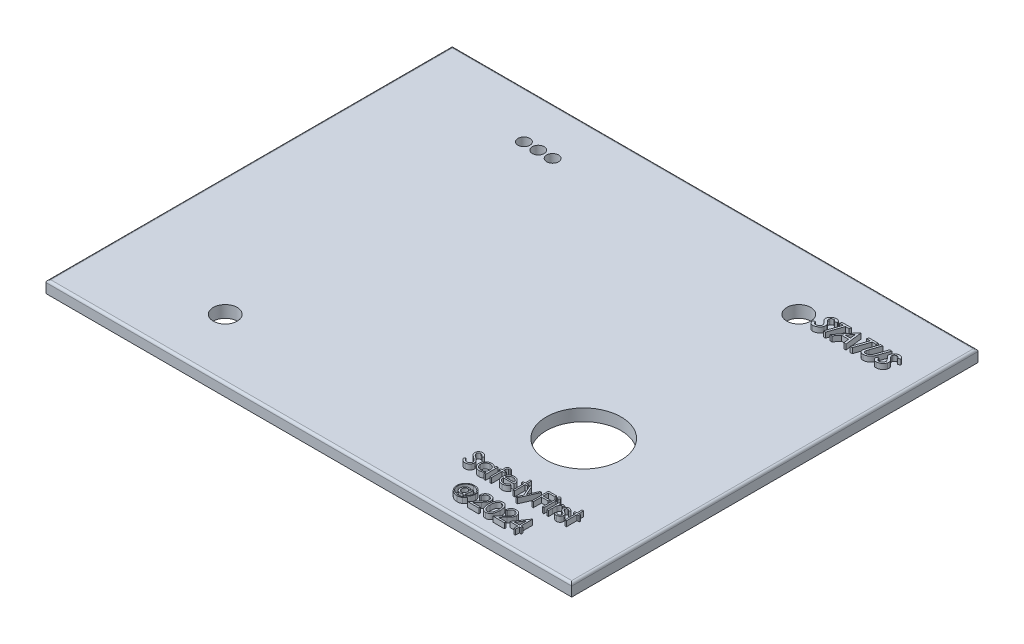
from build123d import *

# Parameters (mm, degrees)
SKETCH1_W           = 110
SKETCH1_H           = 85
BOSS_EXTRUDE1_DEPTH = 2.5
SKETCH2_R           = 2.5
CUT_EXTRUDE2_DEPTH  = 10
SKETCH3_R           = 1.25
CUT_EXTRUDE3_DEPTH  = 10
SKETCH4_R           = 7.825
CUT_EXTRUDE4_DEPTH  = 10
SKETCH5_R           = 2.5
CUT_EXTRUDE5_DEPTH  = 10
BOSS_EXTRUDE3_DEPTH = 1.1
SKETCH7_W           = 0.314102564
SKETCH7_H           = 2.557692308
BOSS_EXTRUDE5_DEPTH = 1.1
FILLET2_R           = 0.5


with BuildPart() as part:
    # Sketch1 → Boss-Extrude1 (new body)
    with BuildSketch(Plane(origin=(0, 0, 0), x_dir=(1, 0, 0), z_dir=(0, 1, 0))):
        Rectangle(SKETCH1_W, SKETCH1_H)
    extrude(amount=BOSS_EXTRUDE1_DEPTH)

    # Sketch2 → Cut-Extrude2 (cut)
    with BuildSketch(Plane(origin=(0, 2.5, 0), x_dir=(1, 0, 0), z_dir=(0, 1, 0))):
        with Locations(Location((-30, -30, 0), (0, 0, 270))):
            Circle(SKETCH2_R)
    extrude(amount=-CUT_EXTRUDE2_DEPTH, mode=Mode.SUBTRACT)

    # Sketch3 → Cut-Extrude3 (cut)
    with BuildSketch(Plane(origin=(0, 2.5, 0), x_dir=(1, 0, 0), z_dir=(0, 1, 0))):
        with Locations(Location((-30, 32.5, 0), (0, 0, 270))):
            Circle(SKETCH3_R)
        with Locations(Location((-27, 32.5, 0), (0, 0, 270))):
            Circle(SKETCH3_R)
        with Locations(Location((-24, 32.5, 0), (0, 0, 270))):
            Circle(SKETCH3_R)
    extrude(amount=-CUT_EXTRUDE3_DEPTH, mode=Mode.SUBTRACT)

    # Sketch4 → Cut-Extrude4 (cut)
    with BuildSketch(Plane(origin=(0, 2.5, 0), x_dir=(1, 0, 0), z_dir=(0, 1, 0))):
        with Locations(Location((30, -15, 0), (0, 0, 270))):
            Circle(SKETCH4_R)
    extrude(amount=-CUT_EXTRUDE4_DEPTH, mode=Mode.SUBTRACT)

    # Sketch5 → Cut-Extrude5 (cut)
    with BuildSketch(Plane(origin=(0, 2.5, 0), x_dir=(1, 0, 0), z_dir=(0, 1, 0))):
        with Locations(Location((30, 30, 0), (0, 0, 270))):
            Circle(SKETCH5_R)
    extrude(amount=-CUT_EXTRUDE5_DEPTH, mode=Mode.SUBTRACT)

    # Sketch6 → Boss-Extrude3 (add)
    # profile 1 of 6: a face of its own
    with BuildSketch(Plane(origin=(0, 2.5, 0), x_dir=(1, 0, 0), z_dir=(0, 1, 0))):
        with BuildLine():
            Line((33.733258315, 29.158419741), (34.184780751, 29.361745061))
            add(Edge.make_bspline(
                [(34.184780751, 29.361745061), (34.196743388, 29.315897364), (34.219396932, 29.229075969), (34.265169382, 29.110016148), (34.316470448, 29.008348403), (34.375475407, 28.924774969), (34.442086484, 28.859096832), (34.516597933, 28.812257292), (34.598504388, 28.783405439), (34.655705418, 28.780090772), (34.68468059, 28.778411728)],
                knots=[0, 0, 0, 0, 1.366242747, 2.587242303, 3.672994386, 4.644237624, 5.526474312, 6.353482186, 7.165956663, 8, 8, 8, 8], degree=3))
            add(Edge.make_bspline(
                [(34.68468059, 28.778411728), (34.713254022, 28.779380611), (34.771234468, 28.781346643), (34.857909795, 28.796805144), (34.945256283, 28.82089723), (35.031872012, 28.8543247), (35.115660993, 28.895855423), (35.19421496, 28.944223224), (35.265034539, 28.999942524), (35.328816208, 29.060839868), (35.384893635, 29.125946006), (35.432398416, 29.193528845), (35.4714962, 29.263178667), (35.490132432, 29.311710592), (35.499384116, 29.335803555)],
                knots=[0, 0, 0, 0, 0.982389124, 1.993437814, 3.019335133, 4.095770719, 5.181531962, 6.23223351, 7.263064189, 8.275167036, 9.261364393, 10.213689592, 11.113212396, 12, 12, 12, 12], degree=3))
            add(Edge.make_bspline(
                [(35.499384116, 29.335803555), (35.507359687, 29.362713785), (35.523019105, 29.415549942), (35.529719684, 29.497544746), (35.522517001, 29.579244469), (35.505785651, 29.631205543), (35.497280751, 29.657618458)],
                knots=[0, 0, 0, 0, 1.023665939, 2.009888962, 2.98838436, 4, 4, 4, 4], degree=3))
            add(Edge.make_bspline(
                [(35.497280751, 29.657618458), (35.489233136, 29.676726193), (35.472243729, 29.717064745), (35.437843097, 29.776753971), (35.397106364, 29.839905003), (35.349294149, 29.906237081), (35.29285863, 29.974417771), (35.229725784, 30.046191073), (35.158592214, 30.120534482), (35.107834925, 30.170283449), (35.081515526, 30.196079997)],
                knots=[0, 0, 0, 0, 0.725921294, 1.53250051, 2.409358469, 3.35948991, 4.395527304, 5.509549822, 6.708616029, 8, 8, 8, 8], degree=3))
            add(Edge.make_bspline(
                [(35.081515526, 30.196079997), (35.054449131, 30.222065856), (35.002700607, 30.271748489), (34.931742598, 30.34569953), (34.867839224, 30.412572483), (34.814154117, 30.47546279), (34.767420282, 30.531604345), (34.730310722, 30.583081138), (34.700535429, 30.628161624), (34.686723314, 30.657958588), (34.68047386, 30.671440574)],
                knots=[0, 0, 0, 0, 1.440931207, 2.754931364, 3.936117262, 4.992495269, 5.930372775, 6.740127158, 7.429955742, 8, 8, 8, 8], degree=3))
            add(Edge.make_bspline(
                [(34.68047386, 30.671440574), (34.671885063, 30.692324298), (34.654793093, 30.733883552), (34.636428565, 30.798951442), (34.625528637, 30.86551651), (34.620338194, 30.933343016), (34.622553293, 31.002430725), (34.632048166, 31.072738564), (34.647309313, 31.144557678), (34.662309694, 31.192016992), (34.669957033, 31.216212208)],
                knots=[0, 0, 0, 0, 0.969882978, 1.930096936, 2.897689013, 3.864446688, 4.849193057, 5.86201719, 6.910035748, 8, 8, 8, 8], degree=3))
            add(Edge.make_bspline(
                [(34.669957033, 31.216212208), (34.68449985, 31.254465657), (34.713812081, 31.33156859), (34.774201095, 31.440580181), (34.84658081, 31.544642283), (34.930251999, 31.642979446), (35.024722645, 31.733776936), (35.12775422, 31.815495606), (35.239544139, 31.885698454), (35.357267987, 31.945727661), (35.478832301, 31.993879445), (35.601634827, 32.028621373), (35.723951065, 32.049677709), (35.805462775, 32.052605909), (35.845738283, 32.054052753)],
                knots=[0, 0, 0, 0, 0.960482324, 1.935930141, 2.918338052, 3.934950457, 4.964001294, 5.99217285, 7.018862584, 8.06002957, 9.092896566, 10.08544053, 11.054002747, 12, 12, 12, 12], degree=3))
            add(Edge.make_bspline(
                [(35.845738283, 32.054052753), (35.889988854, 32.052528403), (35.975549636, 32.049580992), (36.099270899, 32.028123084), (36.21209582, 31.989720431), (36.299131732, 31.946297888), (36.363105432, 31.902159919), (36.409223924, 31.862796299), (36.453910842, 31.817189421), (36.496986261, 31.765578526), (36.538696719, 31.707474115), (36.578309511, 31.643180423), (36.616264873, 31.572505606), (36.639854279, 31.522941295), (36.652028347, 31.497362048)],
                knots=[0, 0, 0, 0, 1.517209808, 2.933604147, 4.286903352, 5.591513207, 6.253966455, 6.947629261, 7.667329603, 8.441002673, 9.250575696, 10.117904152, 11.028684271, 12, 12, 12, 12], degree=3))
            Line((36.652028347, 31.497362048), (36.199103667, 31.246360446))
            add(Edge.make_bspline(
                [(36.199103667, 31.246360446), (36.187038411, 31.266744151), (36.163843838, 31.305930334), (36.128980179, 31.361647142), (36.094389655, 31.410972387), (36.06247945, 31.45598792), (36.03034981, 31.493974966), (35.999839985, 31.526877965), (35.970925698, 31.554323159), (35.933134896, 31.582510567), (35.883605125, 31.609885715), (35.819551649, 31.634239495), (35.749026344, 31.647170038), (35.700419399, 31.649173794), (35.675365687, 31.6502066)],
                knots=[0, 0, 0, 0, 1.215895862, 2.337470802, 3.372356939, 4.308146137, 5.168290878, 5.923677575, 6.611245207, 7.211060785, 8.338969284, 9.504341646, 10.713650776, 12, 12, 12, 12], degree=3))
            add(Edge.make_bspline(
                [(35.675365687, 31.6502066), (35.647198158, 31.648803686), (35.590606872, 31.645985098), (35.507116104, 31.624575745), (35.425455595, 31.590637782), (35.347889445, 31.542844831), (35.275848259, 31.485094007), (35.215116742, 31.416147627), (35.165180716, 31.338520319), (35.142730636, 31.281178028), (35.131295174, 31.25196942)],
                knots=[0, 0, 0, 0, 0.941623222, 1.891811974, 2.866273965, 3.890870804, 4.930192469, 5.943899404, 6.952678138, 8, 8, 8, 8], degree=3))
            add(Edge.make_bspline(
                [(35.131295174, 31.25196942), (35.125270804, 31.233384783), (35.113446457, 31.196907742), (35.103156661, 31.141571857), (35.098714114, 31.087751524), (35.100616941, 31.035170654), (35.110003225, 30.98331833), (35.126277844, 30.931989606), (35.149738978, 30.880584334), (35.170377156, 30.848122647), (35.181074821, 30.831296343)],
                knots=[0, 0, 0, 0, 1.061690431, 2.083835451, 3.05291063, 3.994329682, 4.936863702, 5.909766272, 6.916541013, 8, 8, 8, 8], degree=3))
            add(Edge.make_bspline(
                [(35.181074821, 30.831296343), (35.186827249, 30.823512209), (35.199874006, 30.805857452), (35.224440827, 30.777705445), (35.255289226, 30.743350873), (35.292795803, 30.703020557), (35.337474036, 30.657236682), (35.388434425, 30.60559822), (35.44596056, 30.547900242), (35.486941588, 30.508022366), (35.508498699, 30.487045542)],
                knots=[0, 0, 0, 0, 0.488404034, 1.107721659, 1.884627782, 2.819503016, 3.887381442, 5.113651768, 6.481704013, 8, 8, 8, 8], degree=3))
            add(Edge.make_bspline(
                [(35.508498699, 30.487045542), (35.537661763, 30.458484586), (35.59411108, 30.403200734), (35.673033536, 30.319960684), (35.742081739, 30.238454377), (35.803859569, 30.160792167), (35.855841498, 30.085094936), (35.898798394, 30.011922265), (35.933777436, 29.941895542), (35.967056406, 29.852636934), (35.992584384, 29.741885357), (36.003046397, 29.60874733), (35.990739775, 29.475229221), (35.965240625, 29.389697551), (35.952308795, 29.346320382)],
                knots=[0, 0, 0, 0, 1.126961503, 2.18139661, 3.16540865, 4.075407739, 4.920159245, 5.698125861, 6.416667466, 7.078222902, 8.324060742, 9.540477173, 10.752659238, 12, 12, 12, 12], degree=3))
            add(Edge.make_bspline(
                [(35.952308795, 29.346320382), (35.940529823, 29.314972706), (35.916756068, 29.251703009), (35.869615348, 29.160987932), (35.815775796, 29.071892448), (35.751988732, 28.986135685), (35.679718605, 28.902804843), (35.598831252, 28.822022464), (35.509221711, 28.744286475), (35.413115379, 28.669036676), (35.311215904, 28.600773342), (35.207244686, 28.539612874), (35.101026738, 28.489190006), (34.993348978, 28.447820392), (34.884375361, 28.414227214), (34.773574549, 28.391288616), (34.661181735, 28.37769438), (34.585859171, 28.375612858), (34.54796184, 28.374565574)],
                knots=[0, 0, 0, 0, 0.888474965, 1.793228361, 2.709591257, 3.650401977, 4.627082336, 5.636340541, 6.683060695, 7.775419217, 8.87524379, 9.937485282, 10.975616154, 11.993234322, 12.998363101, 14.000018463, 14.993741594, 16, 16, 16, 16], degree=3))
            add(Edge.make_bspline(
                [(34.54796184, 28.374565574), (34.521304614, 28.375164517), (34.469045633, 28.37633869), (34.392285426, 28.383775579), (34.319641521, 28.397859996), (34.250839224, 28.417174078), (34.185331268, 28.440345722), (34.124273708, 28.471176976), (34.06641966, 28.506018482), (34.012425478, 28.546972439), (33.962949372, 28.595381672), (33.917082409, 28.65113338), (33.875520534, 28.71526406), (33.839641838, 28.788477723), (33.805487418, 28.868880184), (33.777392554, 28.958266821), (33.752708463, 29.055443196), (33.739895012, 29.123282519), (33.733258315, 29.158419741)],
                knots=[0, 0, 0, 0, 1.016743274, 1.993229434, 2.937199628, 3.834660296, 4.717258582, 5.582263595, 6.438313194, 7.290455994, 8.16031522, 9.07217833, 10.038851953, 11.067287897, 12.178024352, 13.367542962, 14.636524905, 16, 16, 16, 16], degree=3))
        make_face()
    # profile 2 of 6: a face of its own
    with BuildSketch(Plane(origin=(0, 2.5, 0), x_dir=(1, 0, 0), z_dir=(0, 1, 0))):
        Polygon((36.987865687, 31.56046301), (37.127388924, 31.964309164), (39.101747898, 31.964309164), (38.962224661, 31.56046301), (38.199404148, 31.56046301), (37.127388924, 28.464309164), (36.678670975, 28.464309164), (37.750686199, 31.56046301), align=None)
    # profile 3 of 6: a face of its own
    with BuildSketch(Plane(origin=(0, 2.5, 0), x_dir=(1, 0, 0), z_dir=(0, 1, 0))):
        Polygon((41.00879918, 31.964309164), (41.435081231, 28.464309164), (40.974444212, 28.464309164), (40.831415366, 29.586104035), (39.399724661, 29.586104035), (38.479852866, 28.464309164), (38.024824821, 28.464309164), (40.868574821, 31.964309164), align=None)
        Polygon((40.674364084, 31.199385285), (39.710321616, 29.989950189), (40.80547386, 29.989950189), align=None, mode=Mode.SUBTRACT)
    # profile 4 of 6: a face of its own
    with BuildSketch(Plane(origin=(0, 2.5, 0), x_dir=(1, 0, 0), z_dir=(0, 1, 0))):
        Polygon((42.596840045, 31.56046301), (42.736363283, 31.964309164), (44.710722257, 31.964309164), (44.57119902, 31.56046301), (43.808378507, 31.56046301), (42.736363283, 28.464309164), (42.287645334, 28.464309164), (43.359660558, 31.56046301), align=None)
    # profile 5 of 6: a face of its own
    with BuildSketch(Plane(origin=(0, 2.5, 0), x_dir=(1, 0, 0), z_dir=(0, 1, 0))):
        with BuildLine():
            Line((45.159440206, 31.964309164), (45.608158154, 31.964309164))
            Line((45.608158154, 31.964309164), (44.876888122, 29.851128074))
            add(Edge.make_bspline(
                [(44.876888122, 29.851128074), (44.866813124, 29.821689587), (44.847787989, 29.766099385), (44.821158622, 29.687023277), (44.797047381, 29.617390587), (44.777439769, 29.556068876), (44.761343166, 29.503933988), (44.748847639, 29.460602075), (44.738410141, 29.426750104), (44.734217335, 29.406644502), (44.732457033, 29.398203394)],
                knots=[0, 0, 0, 0, 1.570200723, 2.965090408, 4.210798552, 5.288710515, 6.213921535, 6.964025246, 7.565057842, 8, 8, 8, 8], degree=3))
            add(Edge.make_bspline(
                [(44.732457033, 29.398203394), (44.725875509, 29.365362123), (44.713488193, 29.303550411), (44.707082157, 29.214571852), (44.710397515, 29.135691437), (44.725381136, 29.065664453), (44.754143414, 29.004053898), (44.793783946, 28.948303689), (44.847361316, 28.899855193), (44.910281939, 28.856993842), (44.981274682, 28.822445892), (45.056905076, 28.797115171), (45.135856078, 28.780984123), (45.189745342, 28.779274316), (45.216932193, 28.778411728)],
                knots=[0, 0, 0, 0, 1.284471063, 2.417548186, 3.414651987, 4.306822474, 5.145680734, 6.006970543, 6.914519789, 7.902219034, 8.921152967, 9.933789913, 10.957607825, 12, 12, 12, 12], degree=3))
            add(Edge.make_bspline(
                [(45.216932193, 28.778411728), (45.24385732, 28.779231771), (45.298229405, 28.780887752), (45.380159769, 28.794262333), (45.46300108, 28.815288444), (45.546016966, 28.844753759), (45.627867998, 28.881826868), (45.706684367, 28.926006345), (45.782489634, 28.975969204), (45.854115453, 29.033135432), (45.922156436, 29.096667981), (45.985204871, 29.167604283), (46.045368812, 29.243605134), (46.080482819, 29.298782259), (46.098242289, 29.326688971)],
                knots=[0, 0, 0, 0, 0.894887916, 1.807119521, 2.753276526, 3.733940512, 4.732091303, 5.73747604, 6.735384797, 7.747564066, 8.78114484, 9.826634624, 10.900785762, 12, 12, 12, 12], degree=3))
            add(Edge.make_bspline(
                [(46.098242289, 29.326688971), (46.105176445, 29.338524024), (46.120409331, 29.36452315), (46.141658097, 29.409127457), (46.165536814, 29.461700118), (46.191474193, 29.522956154), (46.219458384, 29.592784073), (46.248660843, 29.671502505), (46.280275468, 29.758421527), (46.301631533, 29.819320991), (46.312785558, 29.851128074)],
                knots=[0, 0, 0, 0, 0.579997801, 1.27413349, 2.088214804, 3.022847757, 4.087603298, 5.270128432, 6.574219792, 8, 8, 8, 8], degree=3))
            Line((46.312785558, 29.851128074), (47.04405559, 31.964309164))
            Line((47.04405559, 31.964309164), (47.492773539, 31.964309164))
            Line((47.492773539, 31.964309164), (46.763606872, 29.858139292))
            add(Edge.make_bspline(
                [(46.763606872, 29.858139292), (46.750424066, 29.820930061), (46.724543778, 29.747881459), (46.684133268, 29.641313498), (46.641983655, 29.540431128), (46.599084964, 29.444868988), (46.555808585, 29.35416281), (46.510954319, 29.268907661), (46.465559642, 29.188660037), (46.418069087, 29.113549551), (46.3679277, 29.041881482), (46.312939367, 28.972562559), (46.251886656, 28.905990285), (46.186603109, 28.839958227), (46.114903344, 28.777346297), (46.038150721, 28.716079947), (45.956117844, 28.656539333), (45.869419022, 28.599347238), (45.778795721, 28.547191585), (45.686431051, 28.500507619), (45.591898669, 28.461767802), (45.49568381, 28.430513985), (45.39800558, 28.404610354), (45.298270012, 28.387546314), (45.197081698, 28.376540906), (45.129087035, 28.375225987), (45.094937001, 28.374565574)],
                knots=[0, 0, 0, 0, 1.185696901, 2.327742283, 3.422826191, 4.469148552, 5.473858686, 6.440957617, 7.362153487, 8.242427997, 9.109078069, 9.988316352, 10.897776078, 11.821029115, 12.775924092, 13.754923889, 14.77009991, 15.819525975, 16.87307609, 17.909056962, 18.925857789, 19.93811719, 20.946059172, 21.958196864, 22.974512947, 24, 24, 24, 24], degree=3))
            add(Edge.make_bspline(
                [(45.094937001, 28.374565574), (45.061266137, 28.375337255), (44.995669302, 28.376840627), (44.899965318, 28.38565265), (44.810170564, 28.401772299), (44.726358223, 28.424075617), (44.64825627, 28.452910711), (44.576351636, 28.488759557), (44.50944892, 28.529967635), (44.450208222, 28.578857737), (44.396402064, 28.631811057), (44.350990132, 28.690327785), (44.312326809, 28.752612525), (44.282435484, 28.819460685), (44.259626485, 28.890212029), (44.24538832, 28.96507927), (44.236949016, 29.043958543), (44.238681588, 29.097871497), (44.239568411, 29.125467016)],
                knots=[0, 0, 0, 0, 1.245616331, 2.426682302, 3.550951944, 4.616241226, 5.631088117, 6.624688084, 7.584116617, 8.53056579, 9.459722034, 10.37109335, 11.263656107, 12.165133466, 13.072807187, 14.006976936, 14.979864734, 16, 16, 16, 16], degree=3))
            add(Edge.make_bspline(
                [(44.239568411, 29.125467016), (44.24097283, 29.144188936), (44.244039294, 29.185067102), (44.254461864, 29.25127699), (44.26980054, 29.327851152), (44.292349314, 29.414229933), (44.317646648, 29.511374394), (44.350582772, 29.617952794), (44.388336388, 29.734773181), (44.41590612, 29.815874795), (44.430273539, 29.858139292)],
                knots=[0, 0, 0, 0, 0.593452787, 1.295767797, 2.117512751, 3.062065334, 4.117893889, 5.291473422, 6.588505127, 8, 8, 8, 8], degree=3))
            Line((44.430273539, 29.858139292), (45.159440206, 31.964309164))
        make_face()
    # profile 6 of 6: a face of its own
    with BuildSketch(Plane(origin=(0, 2.5, 0), x_dir=(1, 0, 0), z_dir=(0, 1, 0))):
        with BuildLine():
            Line((46.970437802, 29.158419741), (47.421960238, 29.361745061))
            add(Edge.make_bspline(
                [(47.421960238, 29.361745061), (47.433922875, 29.315897364), (47.456576419, 29.229075969), (47.502348869, 29.110016148), (47.553649936, 29.008348403), (47.612654894, 28.924774969), (47.679265971, 28.859096832), (47.753777421, 28.812257292), (47.835683875, 28.783405439), (47.892884905, 28.780090772), (47.921860078, 28.778411728)],
                knots=[0, 0, 0, 0, 1.366242747, 2.587242303, 3.672994386, 4.644237624, 5.526474312, 6.353482186, 7.165956663, 8, 8, 8, 8], degree=3))
            add(Edge.make_bspline(
                [(47.921860078, 28.778411728), (47.950433509, 28.779380611), (48.008413955, 28.781346643), (48.095089282, 28.796805144), (48.18243577, 28.82089723), (48.269051499, 28.8543247), (48.35284048, 28.895855423), (48.431394447, 28.944223224), (48.502214026, 28.999942524), (48.565995695, 29.060839868), (48.622073122, 29.125946006), (48.669577903, 29.193528845), (48.708675687, 29.263178667), (48.727311919, 29.311710592), (48.736563603, 29.335803555)],
                knots=[0, 0, 0, 0, 0.982389124, 1.993437814, 3.019335133, 4.095770719, 5.181531962, 6.23223351, 7.263064189, 8.275167036, 9.261364393, 10.213689592, 11.113212396, 12, 12, 12, 12], degree=3))
            add(Edge.make_bspline(
                [(48.736563603, 29.335803555), (48.744539174, 29.362713785), (48.760198592, 29.415549942), (48.766899171, 29.497544746), (48.759696488, 29.579244469), (48.742965138, 29.631205543), (48.734460238, 29.657618458)],
                knots=[0, 0, 0, 0, 1.023665939, 2.009888962, 2.98838436, 4, 4, 4, 4], degree=3))
            add(Edge.make_bspline(
                [(48.734460238, 29.657618458), (48.726412624, 29.676726193), (48.709423216, 29.717064745), (48.675022584, 29.776753971), (48.634285851, 29.839905003), (48.586473636, 29.906237081), (48.530038117, 29.974417771), (48.466905272, 30.046191073), (48.395771702, 30.120534482), (48.345014412, 30.170283449), (48.318695013, 30.196079997)],
                knots=[0, 0, 0, 0, 0.725921294, 1.53250051, 2.409358469, 3.35948991, 4.395527304, 5.509549822, 6.708616029, 8, 8, 8, 8], degree=3))
            add(Edge.make_bspline(
                [(48.318695013, 30.196079997), (48.291628618, 30.222065856), (48.239880094, 30.271748489), (48.168922085, 30.34569953), (48.105018712, 30.412572483), (48.051333604, 30.47546279), (48.00459977, 30.531604345), (47.967490209, 30.583081138), (47.937714917, 30.628161624), (47.923902801, 30.657958588), (47.917653347, 30.671440574)],
                knots=[0, 0, 0, 0, 1.440931207, 2.754931364, 3.936117262, 4.992495269, 5.930372775, 6.740127158, 7.429955742, 8, 8, 8, 8], degree=3))
            add(Edge.make_bspline(
                [(47.917653347, 30.671440574), (47.90906455, 30.692324298), (47.89197258, 30.733883552), (47.873608052, 30.798951442), (47.862708124, 30.86551651), (47.857517681, 30.933343016), (47.85973278, 31.002430725), (47.869227653, 31.072738564), (47.8844888, 31.144557678), (47.899489181, 31.192016992), (47.90713652, 31.216212208)],
                knots=[0, 0, 0, 0, 0.969882978, 1.930096936, 2.897689013, 3.864446688, 4.849193057, 5.86201719, 6.910035748, 8, 8, 8, 8], degree=3))
            add(Edge.make_bspline(
                [(47.90713652, 31.216212208), (47.921679338, 31.254465657), (47.950991568, 31.33156859), (48.011380582, 31.440580181), (48.083760298, 31.544642283), (48.167431486, 31.642979446), (48.261902132, 31.733776936), (48.364933708, 31.815495606), (48.476723626, 31.885698454), (48.594447475, 31.945727661), (48.716011788, 31.993879445), (48.838814314, 32.028621373), (48.961130552, 32.049677709), (49.042642263, 32.052605909), (49.08291777, 32.054052753)],
                knots=[0, 0, 0, 0, 0.960482324, 1.935930141, 2.918338052, 3.934950457, 4.964001294, 5.99217285, 7.018862584, 8.06002957, 9.092896566, 10.08544053, 11.054002747, 12, 12, 12, 12], degree=3))
            add(Edge.make_bspline(
                [(49.08291777, 32.054052753), (49.127168341, 32.052528403), (49.212729123, 32.049580992), (49.336450386, 32.028123084), (49.449275307, 31.989720431), (49.536311219, 31.946297888), (49.60028492, 31.902159919), (49.646403411, 31.862796299), (49.691090329, 31.817189421), (49.734165748, 31.765578526), (49.775876206, 31.707474115), (49.815488999, 31.643180423), (49.85344436, 31.572505606), (49.877033767, 31.522941295), (49.889207834, 31.497362048)],
                knots=[0, 0, 0, 0, 1.517209808, 2.933604147, 4.286903352, 5.591513207, 6.253966455, 6.947629261, 7.667329603, 8.441002673, 9.250575696, 10.117904152, 11.028684271, 12, 12, 12, 12], degree=3))
            Line((49.889207834, 31.497362048), (49.436283154, 31.246360446))
            add(Edge.make_bspline(
                [(49.436283154, 31.246360446), (49.424217898, 31.266744151), (49.401023325, 31.305930334), (49.366159666, 31.361647142), (49.331569142, 31.410972387), (49.299658937, 31.45598792), (49.267529297, 31.493974966), (49.237019472, 31.526877965), (49.208105185, 31.554323159), (49.170314383, 31.582510567), (49.120784612, 31.609885715), (49.056731136, 31.634239495), (48.986205831, 31.647170038), (48.937598886, 31.649173794), (48.912545174, 31.6502066)],
                knots=[0, 0, 0, 0, 1.215895862, 2.337470802, 3.372356939, 4.308146137, 5.168290878, 5.923677575, 6.611245207, 7.211060785, 8.338969284, 9.504341646, 10.713650776, 12, 12, 12, 12], degree=3))
            add(Edge.make_bspline(
                [(48.912545174, 31.6502066), (48.884377645, 31.648803686), (48.827786359, 31.645985098), (48.744295591, 31.624575745), (48.662635082, 31.590637782), (48.585068932, 31.542844831), (48.513027747, 31.485094007), (48.452296229, 31.416147627), (48.402360204, 31.338520319), (48.379910123, 31.281178028), (48.368474661, 31.25196942)],
                knots=[0, 0, 0, 0, 0.941623222, 1.891811974, 2.866273965, 3.890870804, 4.930192469, 5.943899404, 6.952678138, 8, 8, 8, 8], degree=3))
            add(Edge.make_bspline(
                [(48.368474661, 31.25196942), (48.362450291, 31.233384783), (48.350625944, 31.196907742), (48.340336148, 31.141571857), (48.335893602, 31.087751524), (48.337796428, 31.035170654), (48.347182712, 30.98331833), (48.363457331, 30.931989606), (48.386918465, 30.880584334), (48.407556643, 30.848122647), (48.418254308, 30.831296343)],
                knots=[0, 0, 0, 0, 1.061690431, 2.083835451, 3.05291063, 3.994329682, 4.936863702, 5.909766272, 6.916541013, 8, 8, 8, 8], degree=3))
            add(Edge.make_bspline(
                [(48.418254308, 30.831296343), (48.424006736, 30.823512209), (48.437053493, 30.805857452), (48.461620314, 30.777705445), (48.492468713, 30.743350873), (48.52997529, 30.703020557), (48.574653523, 30.657236682), (48.625613912, 30.60559822), (48.683140048, 30.547900242), (48.724121075, 30.508022366), (48.745678187, 30.487045542)],
                knots=[0, 0, 0, 0, 0.488404034, 1.107721659, 1.884627782, 2.819503016, 3.887381442, 5.113651768, 6.481704013, 8, 8, 8, 8], degree=3))
            add(Edge.make_bspline(
                [(48.745678187, 30.487045542), (48.77484125, 30.458484586), (48.831290567, 30.403200734), (48.910213024, 30.319960684), (48.979261226, 30.238454377), (49.041039056, 30.160792167), (49.093020986, 30.085094936), (49.135977881, 30.011922265), (49.170956923, 29.941895542), (49.204235893, 29.852636934), (49.229763871, 29.741885357), (49.240225884, 29.60874733), (49.227919263, 29.475229221), (49.202420112, 29.389697551), (49.189488283, 29.346320382)],
                knots=[0, 0, 0, 0, 1.126961503, 2.18139661, 3.16540865, 4.075407739, 4.920159245, 5.698125861, 6.416667466, 7.078222902, 8.324060742, 9.540477173, 10.752659238, 12, 12, 12, 12], degree=3))
            add(Edge.make_bspline(
                [(49.189488283, 29.346320382), (49.177709311, 29.314972706), (49.153935555, 29.251703009), (49.106794835, 29.160987932), (49.052955283, 29.071892448), (48.989168219, 28.986135685), (48.916898092, 28.902804843), (48.836010739, 28.822022464), (48.746401198, 28.744286475), (48.650294867, 28.669036676), (48.548395392, 28.600773342), (48.444424173, 28.539612874), (48.338206225, 28.489190006), (48.230528465, 28.447820392), (48.121554849, 28.414227214), (48.010754036, 28.391288616), (47.898361222, 28.37769438), (47.823038659, 28.375612858), (47.785141328, 28.374565574)],
                knots=[0, 0, 0, 0, 0.888474965, 1.793228361, 2.709591257, 3.650401977, 4.627082336, 5.636340541, 6.683060695, 7.775419217, 8.87524379, 9.937485282, 10.975616154, 11.993234322, 12.998363101, 14.000018463, 14.993741594, 16, 16, 16, 16], degree=3))
            add(Edge.make_bspline(
                [(47.785141328, 28.374565574), (47.758484101, 28.375164517), (47.70622512, 28.37633869), (47.629464913, 28.383775579), (47.556821008, 28.397859996), (47.488018712, 28.417174078), (47.422510755, 28.440345722), (47.361453195, 28.471176976), (47.303599147, 28.506018482), (47.249604965, 28.546972439), (47.200128859, 28.595381672), (47.154261896, 28.65113338), (47.112700021, 28.71526406), (47.076821325, 28.788477723), (47.042666905, 28.868880184), (47.014572041, 28.958266821), (46.98988795, 29.055443196), (46.977074499, 29.123282519), (46.970437802, 29.158419741)],
                knots=[0, 0, 0, 0, 1.016743274, 1.993229434, 2.937199628, 3.834660296, 4.717258582, 5.582263595, 6.438313194, 7.290455994, 8.16031522, 9.07217833, 10.038851953, 11.067287897, 12.178024352, 13.367542962, 14.636524905, 16, 16, 16, 16], degree=3))
        make_face()
    extrude(amount=BOSS_EXTRUDE3_DEPTH)

    # Sketch7 → Boss-Extrude5 (add)
    # profile 1 of 17: a face of its own
    with BuildSketch(Plane(origin=(0, 2.5, 0), x_dir=(1, 0, 0), z_dir=(0, 1, 0))):
        with BuildLine():
            Line((22.033876618, -32.156834601), (22.329750016, -31.979450787))
            add(Edge.make_bspline(
                [(22.329750016, -31.979450787), (22.357268253, -32.025515172), (22.409992134, -32.113772755), (22.497943493, -32.233030796), (22.589076404, -32.334392953), (22.684065737, -32.41726956), (22.782331686, -32.482518447), (22.884515739, -32.528720679), (22.99027355, -32.557536654), (23.062247371, -32.561036741), (23.098179503, -32.56278412)],
                knots=[0, 0, 0, 0, 1.272034388, 2.437168799, 3.508375237, 4.49857839, 5.41946034, 6.295179144, 7.148887113, 8, 8, 8, 8], degree=3))
            add(Edge.make_bspline(
                [(23.098179503, -32.56278412), (23.128866363, -32.561929447), (23.189703136, -32.560235057), (23.279265379, -32.543954255), (23.366247182, -32.518942126), (23.448855819, -32.483121195), (23.525951434, -32.439782709), (23.593558129, -32.387436531), (23.652004242, -32.328830326), (23.699813357, -32.263447671), (23.736493392, -32.193130523), (23.764685461, -32.120954571), (23.780330534, -32.045786003), (23.782687288, -31.99517554), (23.783876618, -31.969635081)],
                knots=[0, 0, 0, 0, 1.095163259, 2.171163733, 3.241058638, 4.321873601, 5.38011039, 6.391990106, 7.366004449, 8.327778327, 9.272591725, 10.192022065, 11.087607919, 12, 12, 12, 12], degree=3))
            add(Edge.make_bspline(
                [(23.783876618, -31.969635081), (23.782402308, -31.940494232), (23.779405249, -31.881255143), (23.754073769, -31.79385549), (23.714224522, -31.70736292), (23.677461879, -31.653861654), (23.658375817, -31.626085402)],
                knots=[0, 0, 0, 0, 0.938893495, 1.908633276, 2.914225137, 4, 4, 4, 4], degree=3))
            add(Edge.make_bspline(
                [(23.658375817, -31.626085402), (23.642705203, -31.606038578), (23.609806708, -31.56395278), (23.553249196, -31.501307544), (23.486883082, -31.436689125), (23.412979527, -31.367630068), (23.328846438, -31.297342272), (23.237118923, -31.222473994), (23.135455064, -31.145872417), (23.064155568, -31.094499851), (23.027366202, -31.067992453)],
                knots=[0, 0, 0, 0, 0.722233717, 1.516239348, 2.393582979, 3.351407094, 4.387010283, 5.505090956, 6.712668013, 8, 8, 8, 8], degree=3))
            add(Edge.make_bspline(
                [(23.027366202, -31.067992453), (22.990542205, -31.041763866), (22.920137529, -30.991616803), (22.821678946, -30.917192519), (22.733634483, -30.84914865), (22.656395467, -30.786844638), (22.58999587, -30.730272033), (22.533912459, -30.679974094), (22.489573902, -30.634590533), (22.464918321, -30.605149191), (22.453848573, -30.591930755)],
                knots=[0, 0, 0, 0, 1.452282411, 2.77665338, 3.964542531, 5.026858415, 5.96415736, 6.766646006, 7.446254459, 8, 8, 8, 8], degree=3))
            add(Edge.make_bspline(
                [(22.453848573, -30.591930755), (22.438376028, -30.571329718), (22.407947191, -30.530815014), (22.367781186, -30.467490156), (22.333642023, -30.402666891), (22.306879691, -30.336171026), (22.284343472, -30.268936097), (22.269185541, -30.200084852), (22.259694145, -30.129926233), (22.258722158, -30.082712733), (22.258235593, -30.05907819)],
                knots=[0, 0, 0, 0, 1.068054152, 2.10047183, 3.106115577, 4.101338837, 5.06977816, 6.043150881, 7.020423561, 8, 8, 8, 8], degree=3))
            add(Edge.make_bspline(
                [(22.258235593, -30.05907819), (22.259540802, -30.022048416), (22.262123322, -29.948780352), (22.283963839, -29.841749522), (22.318436733, -29.739563105), (22.36673162, -29.643232771), (22.428988973, -29.55526679), (22.501034948, -29.474653303), (22.586846434, -29.406884721), (22.680999057, -29.347672662), (22.784055429, -29.301326737), (22.892046333, -29.266365757), (23.005143405, -29.246556499), (23.081746539, -29.243713734), (23.1206154, -29.242271299)],
                knots=[0, 0, 0, 0, 1.005424448, 1.989358655, 2.955360095, 3.929531133, 4.905563448, 5.876582895, 6.856512386, 7.866279853, 8.892233794, 9.918561126, 10.94386622, 12, 12, 12, 12], degree=3))
            add(Edge.make_bspline(
                [(23.1206154, -29.242271299), (23.161859501, -29.243693851), (23.243880852, -29.246522852), (23.364530068, -29.271120383), (23.480690784, -29.311821055), (23.574134049, -29.358009713), (23.647266811, -29.404141129), (23.703039543, -29.446160953), (23.759556994, -29.494536062), (23.817275049, -29.549395308), (23.875215708, -29.611242059), (23.934239161, -29.679652748), (23.994483429, -29.754209304), (24.03323929, -29.807433805), (24.053107387, -29.834719216)],
                knots=[0, 0, 0, 0, 1.286793592, 2.559021753, 3.825965368, 5.121522368, 5.803751409, 6.523245864, 7.299691795, 8.125521123, 9.008227632, 9.944561021, 10.946284179, 12, 12, 12, 12], degree=3))
            Line((24.053107387, -29.834719216), (23.769153061, -30.049963607))
            add(Edge.make_bspline(
                [(23.769153061, -30.049963607), (23.752007128, -30.027874917), (23.718988071, -29.985337263), (23.668858584, -29.925765948), (23.621609936, -29.871349468), (23.575059536, -29.82408434), (23.531665905, -29.781382207), (23.489548863, -29.74482245), (23.449314511, -29.714046855), (23.398597601, -29.681203295), (23.334879883, -29.648646791), (23.254895346, -29.621097713), (23.171309071, -29.604542651), (23.11437944, -29.602353764), (23.085559311, -29.601245658)],
                knots=[0, 0, 0, 0, 1.181633172, 2.275549214, 3.290209073, 4.226197932, 5.078386478, 5.862611352, 6.581680152, 7.217281963, 8.414376989, 9.595101626, 10.782541182, 12, 12, 12, 12], degree=3))
            add(Edge.make_bspline(
                [(23.085559311, -29.601245658), (23.049402788, -29.602457358), (22.979678341, -29.604794008), (22.880688105, -29.630313993), (22.79159418, -29.670495853), (22.715041615, -29.726810831), (22.651304637, -29.793531824), (22.605199179, -29.870310679), (22.577449014, -29.955093082), (22.574062734, -30.014234738), (22.572338157, -30.044354633)],
                knots=[0, 0, 0, 0, 1.14458467, 2.207223713, 3.21896685, 4.227309161, 5.202851033, 6.127160689, 7.046193047, 8, 8, 8, 8], degree=3))
            add(Edge.make_bspline(
                [(22.572338157, -30.044354633), (22.572731283, -30.063106111), (22.573518179, -30.100639731), (22.584492977, -30.156091153), (22.598592306, -30.211402492), (22.620934938, -30.266325075), (22.651780241, -30.321819434), (22.692285417, -30.378841172), (22.743298729, -30.43789288), (22.782375742, -30.476300254), (22.803007227, -30.49657819)],
                knots=[0, 0, 0, 0, 0.858281714, 1.717966888, 2.583508476, 3.4729293, 4.427298488, 5.488583878, 6.674047936, 8, 8, 8, 8], degree=3))
            add(Edge.make_bspline(
                [(22.803007227, -30.49657819), (22.8106686, -30.503415216), (22.828870267, -30.519658425), (22.862146192, -30.546250705), (22.906088991, -30.579053478), (22.959551192, -30.619640794), (23.023518554, -30.666722256), (23.09799811, -30.719695868), (23.182159643, -30.780281327), (23.241881559, -30.822638868), (23.273459952, -30.845035723)],
                knots=[0, 0, 0, 0, 0.420754252, 0.999615792, 1.744751191, 2.668019286, 3.750313428, 4.999500688, 6.413464383, 8, 8, 8, 8], degree=3))
            add(Edge.make_bspline(
                [(23.273459952, -30.845035723), (23.311445865, -30.872677082), (23.385000321, -30.926200744), (23.489657901, -31.006616424), (23.584551709, -31.085264192), (23.670014913, -31.1616418), (23.746891821, -31.235169893), (23.814329542, -31.306733073), (23.873015222, -31.375818646), (23.936194441, -31.464391221), (24.00075226, -31.573172305), (24.056193768, -31.706450544), (24.091152115, -31.840246865), (24.095723631, -31.930173701), (24.097979182, -31.974542934)],
                knots=[0, 0, 0, 0, 1.163667725, 2.253281268, 3.268753668, 4.215851969, 5.092017293, 5.902905408, 6.650798638, 7.335211899, 8.59617414, 9.77448103, 10.901945474, 12, 12, 12, 12], degree=3))
            add(Edge.make_bspline(
                [(24.097979182, -31.974542934), (24.097322044, -32.005921299), (24.096020529, -32.068068683), (24.081059615, -32.15932376), (24.05913995, -32.247954629), (24.026102716, -32.332865742), (23.985779558, -32.415610504), (23.93461331, -32.494018405), (23.875305625, -32.569824803), (23.80727186, -32.641008295), (23.732825958, -32.706354491), (23.654142264, -32.764483552), (23.571091991, -32.812951876), (23.484125674, -32.852502718), (23.393223337, -32.883436235), (23.298415553, -32.905849104), (23.199546042, -32.919604815), (23.132345561, -32.921032577), (23.098179503, -32.921758479)],
                knots=[0, 0, 0, 0, 0.983748083, 1.948392443, 2.894712957, 3.844097841, 4.80183111, 5.778335162, 6.776009319, 7.81870978, 8.863265674, 9.881300176, 10.883814829, 11.87499822, 12.874611388, 13.892143829, 14.928324115, 16, 16, 16, 16], degree=3))
            add(Edge.make_bspline(
                [(23.098179503, -32.921758479), (23.07174416, -32.921247297), (23.0192064, -32.920231372), (22.941496918, -32.911250092), (22.865357329, -32.898542988), (22.791743047, -32.878368918), (22.719705635, -32.853891941), (22.649558401, -32.823753608), (22.581267347, -32.787636407), (22.514449764, -32.746341382), (22.449275589, -32.698283638), (22.386356121, -32.642310141), (22.323626936, -32.579964636), (22.262939539, -32.509554073), (22.203066395, -32.43221599), (22.145187986, -32.347226807), (22.088106268, -32.255049453), (22.0522908, -32.190184367), (22.033876618, -32.156834601)],
                knots=[0, 0, 0, 0, 0.915332311, 1.819136955, 2.706846663, 3.586547465, 4.459518054, 5.340707479, 6.227863349, 7.133153174, 8.059268498, 9.028702269, 10.047606654, 11.120612155, 12.245963614, 13.433783089, 14.680604001, 16, 16, 16, 16], degree=3))
        make_face()
    # profile 2 of 17: a face of its own
    with BuildSketch(Plane(origin=(0, 2.5, 0), x_dir=(1, 0, 0), z_dir=(0, 1, 0))):
        with BuildLine():
            Line((27.328748413, -30.274322581), (27.328748413, -32.832014889))
            Line((27.328748413, -32.832014889), (27.014645849, -32.832014889))
            Line((27.014645849, -32.832014889), (27.014645849, -32.389607037))
            add(Edge.make_bspline(
                [(27.014645849, -32.389607037), (26.979227058, -32.429646631), (26.910106843, -32.507784402), (26.794665725, -32.609866574), (26.672297547, -32.694244896), (26.543596226, -32.762394811), (26.408677983, -32.813586868), (26.267841895, -32.849973027), (26.121030515, -32.873366862), (26.02077816, -32.875702884), (25.969974375, -32.876886684)],
                knots=[0, 0, 0, 0, 1.074387032, 2.096679803, 3.090159297, 4.057316773, 5.018401886, 5.985159533, 6.978961417, 8, 8, 8, 8], degree=3))
            add(Edge.make_bspline(
                [(25.969974375, -32.876886684), (25.924806421, -32.875660312), (25.835733216, -32.873241851), (25.704704139, -32.854479548), (25.578611889, -32.824348926), (25.457337317, -32.782448037), (25.341665171, -32.726867215), (25.230605075, -32.660325967), (25.124732383, -32.581085137), (25.025660844, -32.490497109), (24.934428843, -32.392102121), (24.854367571, -32.287156574), (24.787614491, -32.176114271), (24.73179441, -32.060381117), (24.688798066, -31.939066197), (24.658824431, -31.812589029), (24.640083985, -31.681099156), (24.637666524, -31.591559633), (24.636440721, -31.546157517)],
                knots=[0, 0, 0, 0, 1.033919861, 2.038935746, 3.024066025, 3.998881131, 4.97069526, 5.957263378, 6.95902576, 7.993208707, 9.027059324, 10.027763471, 11.009749337, 11.988697705, 12.965288445, 13.950418724, 14.960734635, 16, 16, 16, 16], degree=3))
            add(Edge.make_bspline(
                [(24.636440721, -31.546157517), (24.637693692, -31.501693814), (24.640170749, -31.41379147), (24.658623969, -31.284512773), (24.689654978, -31.159994512), (24.733202825, -31.040637569), (24.78904478, -30.926297518), (24.856972867, -30.816893493), (24.936991992, -30.712124096), (25.029244399, -30.614452869), (25.129179169, -30.524232255), (25.2360879, -30.445823209), (25.347311181, -30.378106361), (25.464574192, -30.324452884), (25.586141297, -30.28104378), (25.713094742, -30.251010812), (25.844906321, -30.23331349), (25.934396813, -30.230750726), (25.97979008, -30.229450787)],
                knots=[0, 0, 0, 0, 1.020392517, 2.01726096, 2.990465484, 3.961182959, 4.928053699, 5.906110375, 6.912531644, 7.948652711, 8.985773172, 9.998621852, 10.987621588, 11.969261332, 12.953316658, 13.946091881, 14.958173133, 16, 16, 16, 16], degree=3))
            add(Edge.make_bspline(
                [(25.97979008, -30.229450787), (26.031989939, -30.230888538), (26.134351399, -30.233707901), (26.284079408, -30.257170628), (26.425723886, -30.296809096), (26.560378238, -30.350726594), (26.687558924, -30.422375323), (26.806061908, -30.512755284), (26.917127392, -30.621296471), (26.981507683, -30.704666915), (27.014645849, -30.747579793)],
                knots=[0, 0, 0, 0, 1.038897134, 2.037228247, 3.008116434, 3.962042015, 4.918381754, 5.904844433, 6.921570401, 8, 8, 8, 8], degree=3))
            Line((27.014645849, -30.747579793), (27.014645849, -30.274322581))
            Line((27.014645849, -30.274322581), (27.328748413, -30.274322581))
        make_face()
        with BuildLine():
            add(Edge.make_bspline(
                [(25.983996811, -30.543553351), (25.938082473, -30.545186988), (25.847454873, -30.548411529), (25.714410871, -30.573585025), (25.587097457, -30.615469619), (25.466151382, -30.67275152), (25.353483166, -30.744780257), (25.252789495, -30.83190164), (25.163246793, -30.931738654), (25.087938529, -31.043840765), (25.026548032, -31.164018856), (24.983381, -31.289643294), (24.954911753, -31.418448271), (24.952003232, -31.505810957), (24.950543285, -31.549663126)],
                knots=[0, 0, 0, 0, 1.031046209, 2.035121221, 3.029706178, 4.034933723, 5.034054252, 6.02443088, 7.017295772, 8.038157696, 9.050218397, 10.03989886, 11.016116709, 12, 12, 12, 12], degree=3))
            add(Edge.make_bspline(
                [(24.950543285, -31.549663126), (24.952408178, -31.593253234), (24.956130655, -31.680262589), (24.982881349, -31.809243166), (25.027761223, -31.934897208), (25.089003286, -32.056158202), (25.16568991, -32.168742302), (25.254578563, -32.270482425), (25.356528844, -32.357972013), (25.469456351, -32.431209587), (25.590064322, -32.490372107), (25.716898253, -32.531537747), (25.847573891, -32.558115528), (25.936426225, -32.561220004), (25.981192323, -32.56278412)],
                knots=[0, 0, 0, 0, 0.979072187, 1.954306742, 2.945804271, 3.96968567, 4.997920485, 5.998718438, 6.996577872, 8.005894225, 9.015743152, 10.005417472, 10.995077863, 12, 12, 12, 12], degree=3))
            add(Edge.make_bspline(
                [(25.981192323, -32.56278412), (26.026638826, -32.561124156), (26.117027413, -32.557822652), (26.250466121, -32.532541387), (26.379961083, -32.490772589), (26.503748312, -32.432873462), (26.619064443, -32.361116106), (26.72256232, -32.277109015), (26.810078289, -32.179405831), (26.884270898, -32.072029378), (26.942446315, -31.954317381), (26.984822374, -31.828983191), (27.00987628, -31.696022443), (27.01303401, -31.605158516), (27.014645849, -31.55877771)],
                knots=[0, 0, 0, 0, 1.01762866, 2.023962475, 3.030623092, 4.058876274, 5.077231937, 6.066672613, 7.034107872, 8.005628644, 8.981990164, 9.965428785, 10.961468474, 12, 12, 12, 12], degree=3))
            add(Edge.make_bspline(
                [(27.014645849, -31.55877771), (27.013686193, -31.523439879), (27.011797285, -31.453883846), (26.997366716, -31.351756328), (26.974411789, -31.254022602), (26.942065619, -31.160579913), (26.899574335, -31.071944898), (26.848326569, -30.987481138), (26.787421119, -30.907627926), (26.717838423, -30.833484855), (26.641673221, -30.765858393), (26.56107868, -30.705494152), (26.475099933, -30.655905379), (26.385182896, -30.614864108), (26.291171562, -30.582204958), (26.192300942, -30.560417264), (26.089621955, -30.545456943), (26.019575899, -30.544194563), (25.983996811, -30.543553351)],
                knots=[0, 0, 0, 0, 1.050140795, 2.067009409, 3.05949893, 4.030605086, 5.00011959, 5.97591094, 6.962425594, 7.979863591, 8.993523472, 9.986985069, 10.967611495, 11.937549037, 12.921786183, 13.919465291, 14.943216303, 16, 16, 16, 16], degree=3))
        make_face(mode=Mode.SUBTRACT)
    # profile 3 of 17: a face of its own
    with BuildSketch(Plane(origin=(0, 2.5, 0), x_dir=(1, 0, 0), z_dir=(0, 1, 0))):
        with BuildLine():
            Line((29.123620208, -29.263304953), (29.123620208, -29.59002771))
            add(Edge.make_bspline(
                [(29.123620208, -29.59002771), (29.093881429, -29.578076837), (29.037436608, -29.555393834), (28.954196232, -29.530729208), (28.877667398, -29.514793468), (28.828513508, -29.512557524), (28.805310913, -29.511502069)],
                knots=[0, 0, 0, 0, 1.16548392, 2.212112691, 3.15604595, 4, 4, 4, 4], degree=3))
            add(Edge.make_bspline(
                [(28.805310913, -29.511502069), (28.789637149, -29.512153409), (28.75929797, -29.513414186), (28.715694643, -29.519842462), (28.676405433, -29.532945263), (28.641499813, -29.549974539), (28.612549353, -29.571328723), (28.587763129, -29.592783987), (28.569796599, -29.616969167), (28.560041651, -29.639489578), (28.554091651, -29.660340571), (28.552301522, -29.681694837), (28.547916608, -29.707918924), (28.546693802, -29.740082642), (28.543906433, -29.777185352), (28.544153074, -29.820012249), (28.541869151, -29.867889391), (28.542211066, -29.90178994), (28.54239024, -29.919554953)],
                knots=[0, 0, 0, 0, 1.311993654, 2.539582093, 3.670788641, 4.763509788, 5.772417512, 6.671800701, 7.496729179, 8.266799162, 8.712543678, 9.304149002, 10.05334463, 10.934920737, 11.99209668, 13.165090968, 14.514413552, 16, 16, 16, 16], degree=3))
            Line((28.54239024, -29.919554953), (28.54239024, -30.274322581))
            Line((28.54239024, -30.274322581), (29.078748413, -30.274322581))
            Line((29.078748413, -30.274322581), (29.078748413, -30.588425146))
            Line((29.078748413, -30.588425146), (28.541689118, -30.588425146))
            Line((28.541689118, -30.588425146), (28.540286875, -32.832014889))
            Line((28.540286875, -32.832014889), (28.226184311, -32.832014889))
            Line((28.226184311, -32.832014889), (28.226184311, -30.588425146))
            Line((28.226184311, -30.588425146), (27.867209952, -30.588425146))
            Line((27.867209952, -30.588425146), (27.867209952, -30.274322581))
            Line((27.867209952, -30.274322581), (28.226184311, -30.274322581))
            Line((28.226184311, -30.274322581), (28.226184311, -29.865568575))
            add(Edge.make_bspline(
                [(28.226184311, -29.865568575), (28.226209525, -29.842892995), (28.226257896, -29.799392091), (28.229645747, -29.736782651), (28.232541468, -29.678959186), (28.238309096, -29.626370554), (28.244970801, -29.57852441), (28.254506961, -29.536131529), (28.263518332, -29.49804977), (28.279866924, -29.454947113), (28.304289143, -29.406097089), (28.34381934, -29.354473189), (28.391212347, -29.308168242), (28.447820671, -29.269160889), (28.511536206, -29.236745411), (28.582417384, -29.213503558), (28.659692582, -29.200363113), (28.713180052, -29.198408904), (28.740807708, -29.197399505)],
                knots=[0, 0, 0, 0, 1.116398763, 2.141702935, 3.087165306, 3.966655413, 4.746276475, 5.464069668, 6.106083417, 6.67047701, 7.730773247, 8.782666744, 9.856985883, 10.980834087, 12.154321827, 13.366232824, 14.639591414, 16, 16, 16, 16], degree=3))
            add(Edge.make_bspline(
                [(28.740807708, -29.197399505), (28.768884466, -29.198356885), (28.827830131, -29.200366855), (28.920026733, -29.212800262), (29.019623251, -29.234271292), (29.087959171, -29.253349177), (29.123620208, -29.263304953)],
                knots=[0, 0, 0, 0, 0.864728408, 1.815451418, 2.859995356, 4, 4, 4, 4], degree=3))
        make_face()
    # profile 4 of 17: a face of its own
    with BuildSketch(Plane(origin=(0, 2.5, 0), x_dir=(1, 0, 0), z_dir=(0, 1, 0))):
        with BuildLine():
            Line((31.671496811, -32.024322581), (31.950543285, -32.170857037))
            add(Edge.make_bspline(
                [(31.950543285, -32.170857037), (31.92830669, -32.210300368), (31.885043081, -32.287041471), (31.810642333, -32.392473331), (31.732650261, -32.487321047), (31.647546293, -32.569050701), (31.557876614, -32.640302086), (31.463143959, -32.702639911), (31.362855141, -32.755758431), (31.257005416, -32.800510959), (31.144705865, -32.834920453), (31.025684349, -32.859224674), (30.899712854, -32.874247943), (30.813366674, -32.875993084), (30.769153061, -32.876886684)],
                knots=[0, 0, 0, 0, 1.120438281, 2.179929193, 3.190490725, 4.156257408, 5.095198341, 6.022838206, 6.959905092, 7.901321166, 8.864066838, 9.862729781, 10.905609505, 12, 12, 12, 12], degree=3))
            add(Edge.make_bspline(
                [(30.769153061, -32.876886684), (30.720011083, -32.875739509), (30.624149321, -32.873501702), (30.484609574, -32.854209238), (30.353230156, -32.822736879), (30.230018452, -32.778771337), (30.1152762, -32.721344013), (30.008775345, -32.651384531), (29.909955819, -32.569252277), (29.82193161, -32.474235833), (29.742687727, -32.372553876), (29.672761907, -32.266597992), (29.614304476, -32.156634767), (29.566751866, -32.043364243), (29.528347001, -31.927500349), (29.501580297, -31.807988882), (29.486150549, -31.685153298), (29.483786104, -31.602055962), (29.482594567, -31.560179953)],
                knots=[0, 0, 0, 0, 1.145258523, 2.234067595, 3.276747158, 4.290159414, 5.277019952, 6.260822364, 7.254936242, 8.264827045, 9.274100331, 10.257902744, 11.220704747, 12.172965371, 13.118907548, 14.062713208, 15.023725156, 16, 16, 16, 16], degree=3))
            add(Edge.make_bspline(
                [(29.482594567, -31.560179953), (29.483653708, -31.520885123), (29.485752787, -31.443007958), (29.498983574, -31.327742414), (29.522431867, -31.215713961), (29.554608191, -31.106829513), (29.596159437, -31.001271379), (29.646991656, -30.898975316), (29.707184034, -30.800050176), (29.753656708, -30.737647042), (29.777065721, -30.706213607)],
                knots=[0, 0, 0, 0, 1.024358464, 2.0301432, 3.019427413, 4.004406732, 4.986367066, 5.972626655, 6.978780325, 8, 8, 8, 8], degree=3))
            add(Edge.make_bspline(
                [(29.777065721, -30.706213607), (29.808773404, -30.668344737), (29.87118435, -30.593806587), (29.976740706, -30.495868261), (30.091040902, -30.413824486), (30.212652528, -30.345817349), (30.342989002, -30.294143703), (30.480298293, -30.25563612), (30.626143879, -30.234058109), (30.7258491, -30.231010276), (30.7768654, -30.229450787)],
                knots=[0, 0, 0, 0, 1.030682036, 2.02871468, 2.997146059, 3.962720338, 4.930598197, 5.918074684, 6.934738563, 8, 8, 8, 8], degree=3))
            add(Edge.make_bspline(
                [(30.7768654, -30.229450787), (30.829313006, -30.230804836), (30.932203252, -30.233461171), (31.082235373, -30.258087504), (31.224196089, -30.297140059), (31.358028593, -30.352293849), (31.483746454, -30.423453401), (31.600532504, -30.511595243), (31.710384016, -30.61401333), (31.774292595, -30.692776539), (31.806813317, -30.732856235)],
                knots=[0, 0, 0, 0, 1.056321875, 2.072262726, 3.055038591, 4.01806755, 4.982017516, 5.957941055, 6.960871419, 8, 8, 8, 8], degree=3))
            add(Edge.make_bspline(
                [(31.806813317, -30.732856235), (31.828940255, -30.763059817), (31.873046848, -30.823265935), (31.928293948, -30.921437093), (31.976251343, -31.024147687), (32.014584304, -31.133057984), (32.045623806, -31.246877564), (32.068080624, -31.366420109), (32.081250243, -31.49165002), (32.08383894, -31.576976576), (32.08515867, -31.620476428)],
                knots=[0, 0, 0, 0, 0.94817472, 1.890038105, 2.849395472, 3.817997239, 4.812318967, 5.836947057, 6.897266129, 8, 8, 8, 8], degree=3))
            Line((32.08515867, -31.620476428), (29.796697131, -31.620476428))
            add(Edge.make_bspline(
                [(29.796697131, -31.620476428), (29.798236737, -31.654176892), (29.801264311, -31.720447496), (29.815379455, -31.817418279), (29.837628228, -31.909791621), (29.868897291, -31.996874663), (29.906764136, -32.07980479), (29.953149853, -32.157966827), (30.008489407, -32.231004757), (30.070215106, -32.299571895), (30.138922202, -32.360632656), (30.211204949, -32.415284432), (30.288098514, -32.461090029), (30.368996597, -32.498269919), (30.453768383, -32.527376235), (30.542440578, -32.547244056), (30.634838694, -32.560551162), (30.697824428, -32.562030828), (30.72989024, -32.56278412)],
                knots=[0, 0, 0, 0, 1.094153842, 2.151609401, 3.174256925, 4.172055639, 5.149267565, 6.128595816, 7.11444997, 8.118368179, 9.117203808, 10.09244225, 11.054858984, 12.015122123, 12.976791628, 13.957293641, 14.960065497, 16, 16, 16, 16], degree=3))
            add(Edge.make_bspline(
                [(30.72989024, -32.56278412), (30.761241388, -32.562176063), (30.823448079, -32.560969562), (30.916088936, -32.549237651), (31.007228463, -32.530267376), (31.096489447, -32.504377386), (31.182060292, -32.472800534), (31.261305843, -32.434697676), (31.334186058, -32.392547929), (31.402303025, -32.344338254), (31.468374018, -32.285330067), (31.533916505, -32.211694346), (31.604193158, -32.124606818), (31.648182751, -32.059061152), (31.671496811, -32.024322581)],
                knots=[0, 0, 0, 0, 0.99110716, 1.966546729, 2.947904876, 3.932708344, 4.903319531, 5.828989031, 6.710028674, 7.56322171, 8.463672341, 9.504779593, 10.677557249, 12, 12, 12, 12], degree=3))
        make_face()
        with BuildLine():
            add(Edge.make_bspline(
                [(31.771056105, -31.306373864), (31.759559481, -31.26471099), (31.737432179, -31.184523369), (31.691195815, -31.073482479), (31.639124274, -30.974794578), (31.577502543, -30.889214945), (31.507683817, -30.813211432), (31.427038635, -30.746792847), (31.336602741, -30.687375396), (31.2368436, -30.637222896), (31.131201815, -30.594533037), (31.020595623, -30.565907922), (30.907737835, -30.546298379), (30.831403549, -30.544472271), (30.792991202, -30.543553351)],
                knots=[0, 0, 0, 0, 1.154881502, 2.222775134, 3.210006277, 4.132804581, 5.035138423, 5.962687519, 6.919655026, 7.923214229, 8.944639381, 9.960483929, 10.97369054, 12, 12, 12, 12], degree=3))
            add(Edge.make_bspline(
                [(30.792991202, -30.543553351), (30.761641763, -30.544165022), (30.699670514, -30.545374168), (30.608369446, -30.556844298), (30.520689747, -30.575804143), (30.435984459, -30.601769099), (30.355363591, -30.636377702), (30.277168823, -30.676960928), (30.203388426, -30.726502512), (30.157247131, -30.764261367), (30.133936714, -30.783337005)],
                knots=[0, 0, 0, 0, 1.04873581, 2.073130211, 3.073294108, 4.04793562, 5.032784715, 6.005352987, 6.992311501, 8, 8, 8, 8], degree=3))
            add(Edge.make_bspline(
                [(30.133936714, -30.783337005), (30.117243432, -30.79843132), (30.083460298, -30.828978536), (30.038319777, -30.881607743), (29.995099304, -30.938359305), (29.955765651, -31.00140443), (29.919688065, -31.070025209), (29.885928088, -31.143642844), (29.855541676, -31.222815974), (29.838445566, -31.277988413), (29.829649855, -31.306373864)],
                knots=[0, 0, 0, 0, 0.879870761, 1.780643979, 2.707998968, 3.669668524, 4.684282772, 5.740141944, 6.837334558, 8, 8, 8, 8], degree=3))
            Line((29.829649855, -31.306373864), (31.771056105, -31.306373864))
        make_face(mode=Mode.SUBTRACT)
    # profile 5 of 17: a face of its own
    with BuildSketch(Plane(origin=(0, 2.5, 0), x_dir=(1, 0, 0), z_dir=(0, 1, 0))):
        Polygon((33.027466362, -29.242271299), (33.341568926, -29.242271299), (33.341568926, -30.274322581), (33.790286875, -30.274322581), (33.790286875, -30.588425146), (33.341568926, -30.588425146), (33.341568926, -32.832014889), (33.027466362, -32.832014889), (33.027466362, -30.588425146), (32.578748413, -30.588425146), (32.578748413, -30.274322581), (33.027466362, -30.274322581), align=None)
    # profile 6 of 17: a face of its own
    with BuildSketch(Plane(origin=(0, 2.5, 0), x_dir=(1, 0, 0), z_dir=(0, 1, 0))):
        Polygon((34.059517644, -30.274322581), (34.398159471, -30.274322581), (35.264044887, -32.233256876), (36.143251618, -30.274322581), (36.482594567, -30.274322581), (34.912081746, -33.774322581), (34.572738798, -33.774322581), (35.093672291, -32.613966011), align=None)
    # profile 7 of 17: a face of its own
    with BuildSketch(Plane(origin=(0, 2.5, 0), x_dir=(1, 0, 0), z_dir=(0, 1, 0))):
        Polygon((36.976184311, -29.332014889), (38.681312516, -29.332014889), (38.681312516, -29.690989248), (37.290286875, -29.690989248), (37.290286875, -30.767912325), (38.681312516, -30.767912325), (38.681312516, -31.126886684), (37.290286875, -31.126886684), (37.290286875, -32.832014889), (36.976184311, -32.832014889), align=None)
    # profile 8 of 17: a face of its own
    with BuildSketch(Plane(origin=(0, 2.5, 0), x_dir=(1, 0, 0), z_dir=(0, 1, 0))):
        with BuildLine():
            add(Edge.make_bspline(
                [(39.330551298, -29.197399505), (39.350042614, -29.198303657), (39.388210353, -29.200074161), (39.443403621, -29.215235638), (39.493660633, -29.240935324), (39.538238366, -29.275415004), (39.576490253, -29.315964448), (39.603270963, -29.363225416), (39.620483359, -29.414284055), (39.622561914, -29.449899144), (39.623620208, -29.468032517)],
                knots=[0, 0, 0, 0, 1.055194115, 2.066272739, 3.074728998, 4.095836921, 5.109056067, 6.073838105, 7.019297344, 8, 8, 8, 8], degree=3))
            add(Edge.make_bspline(
                [(39.623620208, -29.468032517), (39.622538048, -29.485695171), (39.620398746, -29.520612146), (39.603284258, -29.570785618), (39.57626202, -29.617389901), (39.538262895, -29.657860611), (39.493654134, -29.692321231), (39.443405348, -29.71802597), (39.388209899, -29.733186108), (39.35004246, -29.734956796), (39.330551298, -29.735861043)],
                knots=[0, 0, 0, 0, 0.96129708, 1.900370562, 2.859976407, 3.87933698, 4.906634145, 5.921202961, 6.938410037, 8, 8, 8, 8], degree=3))
            add(Edge.make_bspline(
                [(39.330551298, -29.735861043), (39.311283023, -29.734991323), (39.273779842, -29.733298526), (39.219413, -29.717728508), (39.169584511, -29.692312435), (39.124919838, -29.65808625), (39.087689645, -29.617141353), (39.060591319, -29.570814059), (39.043516358, -29.520604904), (39.041371729, -29.485692738), (39.040286875, -29.468032517)],
                knots=[0, 0, 0, 0, 1.054934014, 2.053291228, 3.073705704, 4.106921865, 5.123545215, 6.088680038, 7.033164197, 8, 8, 8, 8], degree=3))
            add(Edge.make_bspline(
                [(39.040286875, -29.468032517), (39.041347961, -29.449901668), (39.043432002, -29.414291535), (39.060604118, -29.363196502), (39.087463926, -29.316215), (39.12494449, -29.275189501), (39.16957795, -29.240944066), (39.219414695, -29.215533085), (39.273779395, -29.199961745), (39.311282871, -29.198269131), (39.330551298, -29.197399505)],
                knots=[0, 0, 0, 0, 0.98631895, 1.937192651, 2.907499808, 3.917963147, 4.944918757, 5.95915025, 6.951458133, 8, 8, 8, 8], degree=3))
        make_face()
    # profile 9 of 17: a face of its own
    with BuildSketch(Plane(origin=(0, 2.5, 0), x_dir=(1, 0, 0), z_dir=(0, 1, 0))):
        with Locations((39.331953541, -31.553168735)):
            Rectangle(SKETCH7_W, SKETCH7_H)
    # profile 10 of 17: a face of its own
    with BuildSketch(Plane(origin=(0, 2.5, 0), x_dir=(1, 0, 0), z_dir=(0, 1, 0))):
        with BuildLine():
            Line((40.162081746, -30.274322581), (40.476184311, -30.274322581))
            Line((40.476184311, -30.274322581), (40.476184311, -30.650824985))
            add(Edge.make_bspline(
                [(40.476184311, -30.650824985), (40.499373069, -30.615769157), (40.54372139, -30.548725158), (40.61743432, -30.460055857), (40.692937651, -30.38664081), (40.770592838, -30.328137291), (40.850970938, -30.284324173), (40.93230789, -30.252231137), (41.01588336, -30.233253822), (41.072045284, -30.230720163), (41.100182708, -30.229450787)],
                knots=[0, 0, 0, 0, 1.2804753, 2.448899062, 3.506932113, 4.484331642, 5.4025378, 6.288909075, 7.142734305, 8, 8, 8, 8], degree=3))
            add(Edge.make_bspline(
                [(41.100182708, -30.229450787), (41.122009034, -30.230641313), (41.16691812, -30.233090899), (41.234900709, -30.250301724), (41.304944161, -30.277779746), (41.350086549, -30.303619969), (41.373620208, -30.317091011)],
                knots=[0, 0, 0, 0, 0.901110191, 1.854092781, 2.881294221, 4, 4, 4, 4], degree=3))
            Line((41.373620208, -30.317091011), (41.201144246, -30.589126267))
            add(Edge.make_bspline(
                [(41.201144246, -30.589126267), (41.186035225, -30.582386001), (41.157355411, -30.569591686), (41.115400845, -30.554449676), (41.076719508, -30.54553376), (41.052075949, -30.544183042), (41.040587355, -30.543553351)],
                knots=[0, 0, 0, 0, 1.180555205, 2.24091978, 3.179933427, 4, 4, 4, 4], degree=3))
            add(Edge.make_bspline(
                [(41.040587355, -30.543553351), (41.015381622, -30.545233388), (40.963969232, -30.548660177), (40.888484733, -30.575598985), (40.815237527, -30.619124225), (40.757065865, -30.667395337), (40.712023612, -30.713943135), (40.679883386, -30.754591537), (40.650400639, -30.800170169), (40.622230419, -30.849899852), (40.596564125, -30.904629698), (40.572609456, -30.963812912), (40.550950593, -31.027518041), (40.538600348, -31.071900561), (40.532274054, -31.094635081)],
                knots=[0, 0, 0, 0, 1.125678352, 2.296057538, 3.5422874, 4.923748041, 5.663163013, 6.437101912, 7.23742474, 8.08941207, 8.991984279, 9.93940061, 10.944477711, 12, 12, 12, 12], degree=3))
            add(Edge.make_bspline(
                [(40.532274054, -31.094635081), (40.527541661, -31.114912255), (40.517059769, -31.159824654), (40.506868231, -31.235173178), (40.496798713, -31.324196837), (40.489702095, -31.42714343), (40.483124053, -31.543755874), (40.479413971, -31.67421182), (40.47631083, -31.818645171), (40.476227763, -31.919619524), (40.476184311, -31.972439569)],
                knots=[0, 0, 0, 0, 0.566838948, 1.255505196, 2.06880316, 3.007127437, 4.065329342, 5.249902469, 6.561414163, 8, 8, 8, 8], degree=3))
            Line((40.476184311, -31.972439569), (40.476184311, -32.832014889))
            Line((40.476184311, -32.832014889), (40.162081746, -32.832014889))
            Line((40.162081746, -32.832014889), (40.162081746, -30.274322581))
        make_face()
    # profile 11 of 17: a face of its own
    with BuildSketch(Plane(origin=(0, 2.5, 0), x_dir=(1, 0, 0), z_dir=(0, 1, 0))):
        with BuildLine():
            Line((42.899261234, -30.593332998), (42.686120208, -30.81278412))
            add(Edge.make_bspline(
                [(42.686120208, -30.81278412), (42.667729704, -30.791470974), (42.632274979, -30.750381737), (42.576043498, -30.69544467), (42.520019894, -30.649307731), (42.464971081, -30.610355472), (42.409512811, -30.580906326), (42.354295893, -30.559411464), (42.299263155, -30.546109658), (42.26247712, -30.544395219), (42.244413477, -30.543553351)],
                knots=[0, 0, 0, 0, 1.26578478, 2.440284043, 3.530471711, 4.527705817, 5.468200915, 6.346673037, 7.188140097, 8, 8, 8, 8], degree=3))
            add(Edge.make_bspline(
                [(42.244413477, -30.543553351), (42.222274087, -30.544628224), (42.178706901, -30.546743422), (42.116281083, -30.567856852), (42.058330458, -30.60026559), (42.008173478, -30.646234174), (41.965685798, -30.698998443), (41.934672117, -30.757994768), (41.915706133, -30.821442811), (41.913301401, -30.865472669), (41.912081746, -30.887804152)],
                knots=[0, 0, 0, 0, 0.99966794, 1.967205029, 2.953328237, 3.988086729, 5.028030931, 6.008226631, 6.989793394, 8, 8, 8, 8], degree=3))
            add(Edge.make_bspline(
                [(41.912081746, -30.887804152), (41.913192559, -30.908016196), (41.915411052, -30.948383307), (41.932657731, -31.007931341), (41.960123803, -31.065988379), (41.985793998, -31.101551285), (41.999020849, -31.119875466)],
                knots=[0, 0, 0, 0, 0.960159726, 1.917612774, 2.927026955, 4, 4, 4, 4], degree=3))
            add(Edge.make_bspline(
                [(41.999020849, -31.119875466), (42.006984343, -31.12966005), (42.023933636, -31.150485305), (42.055742151, -31.179389158), (42.091764653, -31.211331409), (42.135084591, -31.243268246), (42.183835619, -31.276899972), (42.239074903, -31.310902105), (42.299049408, -31.347866529), (42.341986715, -31.371310965), (42.364305304, -31.383497261)],
                knots=[0, 0, 0, 0, 0.66740084, 1.420478572, 2.27185888, 3.217733974, 4.268547843, 5.408967954, 6.65319498, 8, 8, 8, 8], degree=3))
            add(Edge.make_bspline(
                [(42.364305304, -31.383497261), (42.391518881, -31.398742164), (42.444086551, -31.428190296), (42.518779319, -31.4739), (42.58656636, -31.519331424), (42.648022027, -31.563998698), (42.701963836, -31.609151565), (42.750028389, -31.653059322), (42.791016833, -31.697048631), (42.813970759, -31.727781744), (42.824942323, -31.74247162)],
                knots=[0, 0, 0, 0, 1.27191281, 2.456916733, 3.569705269, 4.599008579, 5.553216877, 6.436649441, 7.252746552, 8, 8, 8, 8], degree=3))
            add(Edge.make_bspline(
                [(42.824942323, -31.74247162), (42.843152851, -31.772137708), (42.87939518, -31.831178729), (42.917453447, -31.928397157), (42.939513721, -32.031507659), (42.942575942, -32.102039879), (42.944133028, -32.137904312)],
                knots=[0, 0, 0, 0, 0.995354457, 1.980940102, 2.973342415, 4, 4, 4, 4], degree=3))
            add(Edge.make_bspline(
                [(42.944133028, -32.137904312), (42.943413495, -32.163173459), (42.941995575, -32.212969072), (42.932137508, -32.286303901), (42.915182531, -32.356438459), (42.892088777, -32.424133744), (42.860904405, -32.488092683), (42.824356607, -32.549928932), (42.780481696, -32.608304863), (42.73039032, -32.663143823), (42.675544826, -32.713229571), (42.617038688, -32.757253524), (42.554799857, -32.793827862), (42.489273056, -32.824093207), (42.420309402, -32.848161465), (42.347898112, -32.864823996), (42.272269358, -32.874796757), (42.22083955, -32.876181233), (42.19463383, -32.876886684)],
                knots=[0, 0, 0, 0, 1.032770009, 2.035186124, 3.017557409, 3.978232242, 4.952395191, 5.920591857, 6.910227898, 7.931268572, 8.952309245, 9.941945286, 10.918353717, 11.897095711, 12.887975737, 13.898235213, 14.929059601, 16, 16, 16, 16], degree=3))
            add(Edge.make_bspline(
                [(42.19463383, -32.876886684), (42.159266654, -32.875893984), (42.089023727, -32.873922377), (41.985134008, -32.855416315), (41.88361325, -32.826620921), (41.785229709, -32.786904987), (41.692183595, -32.736754274), (41.607052671, -32.676691881), (41.529541208, -32.608701883), (41.485422935, -32.556588973), (41.463363798, -32.530532517)],
                knots=[0, 0, 0, 0, 1.013940152, 2.01379169, 3.017749504, 4.037548394, 5.051665909, 6.043208538, 7.021604269, 8, 8, 8, 8], degree=3))
            Line((41.463363798, -32.530532517), (41.671596971, -32.293553351))
            add(Edge.make_bspline(
                [(41.671596971, -32.293553351), (41.691369384, -32.314908115), (41.729701196, -32.356307555), (41.791002413, -32.411431896), (41.853381814, -32.457633167), (41.9162165, -32.496276582), (41.980436595, -32.526051985), (42.045682209, -32.546970579), (42.111820633, -32.560414771), (42.156242769, -32.561993053), (42.178508028, -32.56278412)],
                knots=[0, 0, 0, 0, 1.179806542, 2.287233372, 3.337373186, 4.324005949, 5.273901747, 6.200048787, 7.097828587, 8, 8, 8, 8], degree=3))
            add(Edge.make_bspline(
                [(42.178508028, -32.56278412), (42.208825954, -32.561413295), (42.268062096, -32.558734933), (42.352905855, -32.534417841), (42.431244481, -32.496287889), (42.499267827, -32.442203191), (42.557169988, -32.379247619), (42.599098162, -32.308333499), (42.625374338, -32.231542043), (42.628460336, -32.17830974), (42.630030464, -32.151225626)],
                knots=[0, 0, 0, 0, 1.072336372, 2.095165389, 3.102688358, 4.141489647, 5.156069229, 6.117746104, 7.042326257, 8, 8, 8, 8], degree=3))
            add(Edge.make_bspline(
                [(42.630030464, -32.151225626), (42.62894417, -32.128916008), (42.626799427, -32.084868652), (42.609956155, -32.021118311), (42.583343303, -31.96064903), (42.557138655, -31.925259383), (42.543792484, -31.907235242)],
                knots=[0, 0, 0, 0, 1.013901739, 2.00181326, 2.98231254, 4, 4, 4, 4], degree=3))
            add(Edge.make_bspline(
                [(42.543792484, -31.907235242), (42.535770089, -31.89819988), (42.518294417, -31.878517598), (42.486239175, -31.850092519), (42.447857313, -31.81945442), (42.40271715, -31.787122831), (42.350727688, -31.753524225), (42.291678213, -31.718834873), (42.22637766, -31.681407147), (42.180207029, -31.656587492), (42.156072131, -31.643613447)],
                knots=[0, 0, 0, 0, 0.615000592, 1.339693406, 2.178160186, 3.116406724, 4.166410947, 5.330106347, 6.604359322, 8, 8, 8, 8], degree=3))
            add(Edge.make_bspline(
                [(42.156072131, -31.643613447), (42.130025491, -31.629074315), (42.079512744, -31.600878299), (42.007965453, -31.556962219), (41.943418098, -31.512294944), (41.884317524, -31.469382105), (41.832156518, -31.425961161), (41.78714057, -31.381983909), (41.747497354, -31.339223923), (41.725549942, -31.308926627), (41.715066522, -31.294454793)],
                knots=[0, 0, 0, 0, 1.262093308, 2.447601706, 3.550203992, 4.582594899, 5.537233252, 6.418365656, 7.244515135, 8, 8, 8, 8], degree=3))
            add(Edge.make_bspline(
                [(41.715066522, -31.294454793), (41.696935922, -31.265309178), (41.660668387, -31.207007763), (41.625453196, -31.109697286), (41.601247167, -31.007252229), (41.599084777, -30.936565374), (41.597979182, -30.900424344)],
                knots=[0, 0, 0, 0, 0.985009483, 1.970363186, 2.962279964, 4, 4, 4, 4], degree=3))
            add(Edge.make_bspline(
                [(41.597979182, -30.900424344), (41.598513378, -30.876798946), (41.599558874, -30.830560695), (41.607902925, -30.762621875), (41.623094636, -30.698073721), (41.642149559, -30.635946858), (41.668632563, -30.577444764), (41.700278469, -30.521787293), (41.737465893, -30.469051375), (41.780309184, -30.420048243), (41.82741583, -30.375538917), (41.878310599, -30.336740289), (41.931848856, -30.303633934), (41.988257275, -30.275868773), (42.048077748, -30.254867391), (42.110892135, -30.240410006), (42.17657329, -30.230754803), (42.221474416, -30.229891719), (42.244413477, -30.229450787)],
                knots=[0, 0, 0, 0, 1.087655834, 2.128696564, 3.144119009, 4.137814668, 5.115653402, 6.093965665, 7.082169637, 8.081268856, 9.086088321, 10.061021666, 11.022561449, 11.980240094, 12.950172527, 13.934149372, 14.944599409, 16, 16, 16, 16], degree=3))
            add(Edge.make_bspline(
                [(42.244413477, -30.229450787), (42.271605541, -30.230555127), (42.326499762, -30.232784525), (42.408854389, -30.250490216), (42.491087731, -30.27962332), (42.573411081, -30.319859553), (42.65522137, -30.371926429), (42.737238227, -30.434855728), (42.820446257, -30.508233443), (42.87240257, -30.564332668), (42.899261234, -30.593332998)],
                knots=[0, 0, 0, 0, 0.845714091, 1.707292901, 2.609013841, 3.555613372, 4.552488639, 5.621697636, 6.770543573, 8, 8, 8, 8], degree=3))
        make_face()
    # profile 12 of 17: a face of its own
    with BuildSketch(Plane(origin=(0, 2.5, 0), x_dir=(1, 0, 0), z_dir=(0, 1, 0))):
        Polygon((43.886440721, -29.242271299), (44.200543285, -29.242271299), (44.200543285, -30.274322581), (44.649261234, -30.274322581), (44.649261234, -30.588425146), (44.200543285, -30.588425146), (44.200543285, -32.832014889), (43.886440721, -32.832014889), (43.886440721, -30.588425146), (43.437722772, -30.588425146), (43.437722772, -30.274322581), (43.886440721, -30.274322581), align=None)
    # profile 13 of 17: a face of its own
    with BuildSketch(Plane(origin=(0, 2.5, 0), x_dir=(1, 0, 0), z_dir=(0, 1, 0))):
        with BuildLine():
            Line((29.431412676, -38.947399505), (29.682414278, -38.947399505))
            add(Edge.make_bspline(
                [(29.682414278, -38.947399505), (29.656449891, -38.978665016), (29.605844789, -39.039602112), (29.52849539, -39.12548828), (29.453894333, -39.205443858), (29.379226602, -39.276468008), (29.307345939, -39.341815273), (29.235577974, -39.398137408), (29.166324167, -39.448715572), (29.119143973, -39.47751256), (29.096276458, -39.491470017)],
                knots=[0, 0, 0, 0, 1.213390222, 2.364921437, 3.45091939, 4.477489221, 5.441250277, 6.350193595, 7.200364195, 8, 8, 8, 8], degree=3))
            add(Edge.make_bspline(
                [(29.096276458, -39.491470017), (29.06404581, -39.509046414), (28.999548576, -39.544218805), (28.898116316, -39.587725014), (28.793972694, -39.626267069), (28.686069934, -39.656755295), (28.575077992, -39.680755303), (28.460745843, -39.697308299), (28.343252424, -39.708292486), (28.263602617, -39.709573242), (28.223379823, -39.710220017)],
                knots=[0, 0, 0, 0, 0.967652149, 1.936383228, 2.907366375, 3.894489712, 4.890576983, 5.899923271, 6.939470695, 8, 8, 8, 8], degree=3))
            add(Edge.make_bspline(
                [(28.223379823, -39.710220017), (28.180578685, -39.709691748), (28.095739258, -39.708644624), (27.970074611, -39.695857038), (27.846818605, -39.67736761), (27.726137625, -39.650259106), (27.60730929, -39.617169795), (27.491678708, -39.574560396), (27.378249177, -39.525427081), (27.267834088, -39.468918976), (27.162036708, -39.405247787), (27.060989432, -39.336713528), (26.967222688, -39.261174201), (26.87846316, -39.181151371), (26.795511393, -39.095831093), (26.719679805, -39.003988945), (26.649420675, -38.907042367), (26.585039435, -38.805045632), (26.527847794, -38.698835438), (26.477927563, -38.589951587), (26.435427128, -38.478557505), (26.401446077, -38.364580013), (26.374382784, -38.248238027), (26.355984994, -38.129635249), (26.343134272, -38.008645641), (26.342093921, -37.927067914), (26.341568926, -37.885901107)],
                knots=[0, 0, 0, 0, 1.054671765, 2.09054602, 3.110664614, 4.125466063, 5.137598463, 6.149074806, 7.160485519, 8.183382118, 9.204004889, 10.202734905, 11.190638985, 12.169548661, 13.14737277, 14.121047053, 15.102868243, 16.097051703, 17.092036063, 18.074229033, 19.047903316, 20.028472937, 21.00393517, 21.98990556, 22.985640179, 24, 24, 24, 24], degree=3))
            add(Edge.make_bspline(
                [(26.341568926, -37.885901107), (26.342511172, -37.844282303), (26.344388388, -37.76136608), (26.355355074, -37.638063445), (26.375572821, -37.517160415), (26.401691754, -37.398173818), (26.437232794, -37.282015866), (26.479227564, -37.167498707), (26.529902908, -37.055790474), (26.587279112, -36.946334356), (26.651334367, -36.841104376), (26.721523486, -36.74125944), (26.797586034, -36.647692552), (26.878901028, -36.56015655), (26.965329364, -36.478065466), (27.058324783, -36.403500472), (27.155865316, -36.333318553), (27.259648089, -36.270838963), (27.366972482, -36.214125812), (27.47730316, -36.164974752), (27.589894616, -36.123286877), (27.705267605, -36.089820251), (27.822978249, -36.062980489), (27.943374398, -36.044142767), (28.066098431, -36.032572277), (28.148801855, -36.031348682), (28.190427099, -36.030732838)],
                knots=[0, 0, 0, 0, 1.027058365, 2.046185658, 3.051117553, 4.050025228, 5.049781473, 6.046005589, 7.057797166, 8.07411433, 9.093779891, 10.095330734, 11.083325814, 12.066732605, 13.041716928, 14.021600531, 15.005700308, 16.004591337, 17.008016425, 17.999304607, 18.982711398, 19.968128194, 20.961410433, 21.95973534, 22.973119735, 24, 24, 24, 24], degree=3))
            add(Edge.make_bspline(
                [(28.190427099, -36.030732838), (28.248919863, -36.032019078), (28.363725488, -36.034543624), (28.532429893, -36.056243408), (28.694135591, -36.091121001), (28.849193902, -36.139912045), (28.996364519, -36.20473573), (29.137577188, -36.281657975), (29.270822901, -36.37433815), (29.396295123, -36.478573261), (29.50987329, -36.592766914), (29.611339455, -36.711723964), (29.695511784, -36.836814347), (29.766321067, -36.965568337), (29.819113964, -37.100180126), (29.858279376, -37.238618503), (29.882116879, -37.381905722), (29.8849888, -37.47916092), (29.886440721, -37.528328992)],
                knots=[0, 0, 0, 0, 1.11831066, 2.194944194, 3.246979174, 4.27888224, 5.297750955, 6.317971723, 7.349497193, 8.396773963, 9.433428718, 10.426349215, 11.382158292, 12.312128617, 13.230936323, 14.140829506, 15.060082842, 16, 16, 16, 16], degree=3))
            add(Edge.make_bspline(
                [(29.886440721, -37.528328992), (29.885990957, -37.563875814), (29.885104678, -37.633922379), (29.875436141, -37.737124957), (29.861290965, -37.836781914), (29.839682162, -37.932643419), (29.813793214, -38.025038083), (29.780011444, -38.113255616), (29.742014596, -38.198261223), (29.696768819, -38.278749892), (29.646955808, -38.355224219), (29.59286007, -38.427597419), (29.534751088, -38.495719709), (29.471979946, -38.559264018), (29.404580393, -38.61781777), (29.33346924, -38.673009703), (29.258055363, -38.723469545), (29.204928459, -38.753076777), (29.178307708, -38.767912325)],
                knots=[0, 0, 0, 0, 1.133597158, 2.233802705, 3.30396869, 4.342264069, 5.366329644, 6.361939563, 7.352848959, 8.334034895, 9.303853874, 10.262605972, 11.214375925, 12.158023099, 13.109033576, 14.060423866, 15.02812001, 16, 16, 16, 16], degree=3))
            add(Edge.make_bspline(
                [(29.178307708, -38.767912325), (29.138710245, -38.788357842), (29.063985746, -38.826940643), (28.952454696, -38.869325556), (28.84986607, -38.896781267), (28.783717042, -38.900694427), (28.752726778, -38.90252771)],
                knots=[0, 0, 0, 0, 1.186206281, 2.23849367, 3.174749084, 4, 4, 4, 4], degree=3))
            add(Edge.make_bspline(
                [(28.752726778, -38.90252771), (28.732526227, -38.90166804), (28.693640354, -38.900013183), (28.638395972, -38.884964426), (28.589516704, -38.859732958), (28.563182398, -38.835391133), (28.55010258, -38.823300947)],
                knots=[0, 0, 0, 0, 1.082052135, 2.082940295, 3.047827814, 4, 4, 4, 4], degree=3))
            add(Edge.make_bspline(
                [(28.55010258, -38.823300947), (28.541038781, -38.811996817), (28.521676115, -38.78784821), (28.504640295, -38.740012955), (28.492454137, -38.68300696), (28.491187857, -38.641099033), (28.490507227, -38.618573383)],
                knots=[0, 0, 0, 0, 0.793528208, 1.695185748, 2.761154694, 4, 4, 4, 4], degree=3))
            add(Edge.make_bspline(
                [(28.490507227, -38.618573383), (28.475729399, -38.63534577), (28.44579873, -38.66931617), (28.391709374, -38.713942913), (28.330122472, -38.754153319), (28.262102626, -38.790107249), (28.189911213, -38.820693452), (28.114573333, -38.840988235), (28.038141131, -38.85556283), (27.986470413, -38.85695506), (27.96045915, -38.857655915)],
                knots=[0, 0, 0, 0, 0.894537205, 1.811774761, 2.798735569, 3.837640279, 4.891504278, 5.932137932, 6.959029326, 8, 8, 8, 8], degree=3))
            add(Edge.make_bspline(
                [(27.96045915, -38.857655915), (27.931672752, -38.857043166), (27.875302833, -38.855843273), (27.79283365, -38.844641523), (27.713877756, -38.828623191), (27.63914409, -38.80315158), (27.567486364, -38.773074268), (27.500547216, -38.734357454), (27.436683629, -38.690162195), (27.377721, -38.638411244), (27.323752601, -38.581440743), (27.277253361, -38.519153558), (27.237531325, -38.452768213), (27.205347698, -38.381658505), (27.180074268, -38.306237792), (27.161666982, -38.226457435), (27.151227642, -38.14209066), (27.149925777, -38.084346988), (27.149261234, -38.05487146)],
                knots=[0, 0, 0, 0, 1.076938101, 2.1088749, 3.110935573, 4.087505955, 5.059323376, 6.01530039, 6.976387481, 7.962317429, 8.946382585, 9.908703191, 10.865920305, 11.83683164, 12.824467887, 13.83886383, 14.896837935, 16, 16, 16, 16], degree=3))
            add(Edge.make_bspline(
                [(27.149261234, -38.05487146), (27.150103804, -38.022582372), (27.151776354, -37.958486724), (27.164143976, -37.863509648), (27.183604423, -37.770539378), (27.211567343, -37.679827678), (27.248913007, -37.591949425), (27.291799364, -37.505289238), (27.344626644, -37.421550538), (27.403801467, -37.340258111), (27.470495794, -37.264892875), (27.543619726, -37.198139147), (27.623593748, -37.142673856), (27.708959519, -37.096392582), (27.801019437, -37.061386093), (27.898863727, -37.036392018), (28.002700402, -37.020336626), (28.073980077, -37.018733609), (28.110499214, -37.017912325)],
                knots=[0, 0, 0, 0, 0.982156527, 1.949635761, 2.909086418, 3.86940613, 4.832039489, 5.811438195, 6.80782758, 7.84029968, 8.867740389, 9.864510254, 10.844863476, 11.821496572, 12.811854966, 13.832804459, 14.889667883, 16, 16, 16, 16], degree=3))
            add(Edge.make_bspline(
                [(28.110499214, -37.017912325), (28.142104623, -37.01880411), (28.203114049, -37.020525564), (28.290737686, -37.035092342), (28.370265519, -37.060515529), (28.443144463, -37.096224909), (28.510787477, -37.145048816), (28.5755591, -37.207613582), (28.637775816, -37.285286395), (28.67501429, -37.344004768), (28.69453367, -37.374783319)],
                knots=[0, 0, 0, 0, 1.048525916, 2.024019497, 2.936514309, 3.810654959, 4.706011411, 5.693488602, 6.790990403, 8, 8, 8, 8], degree=3))
            Line((28.69453367, -37.374783319), (28.745014439, -37.06278412))
            Line((28.745014439, -37.06278412), (29.016348573, -37.06278412))
            Line((29.016348573, -37.06278412), (28.817931105, -38.526726428))
            add(Edge.make_bspline(
                [(28.817931105, -38.526726428), (28.816812655, -38.537482146), (28.814842685, -38.556426601), (28.811656898, -38.581137802), (28.810400903, -38.598471061), (28.809750887, -38.607589214), (28.809517644, -38.610861043)],
                knots=[0, 0, 0, 0, 1.534509141, 2.702789396, 3.534527252, 4, 4, 4, 4], degree=3))
            add(Edge.make_bspline(
                [(28.809517644, -38.610861043), (28.811057877, -38.620734997), (28.81427913, -38.641385447), (28.841526409, -38.663765028), (28.878005355, -38.676404427), (28.905893905, -38.677548955), (28.920996009, -38.678168735)],
                knots=[0, 0, 0, 0, 0.807623339, 1.689068618, 2.748592994, 4, 4, 4, 4], degree=3))
            add(Edge.make_bspline(
                [(28.920996009, -38.678168735), (28.932494458, -38.67784739), (28.956442064, -38.677178129), (28.992921567, -38.668407605), (29.032108944, -38.65678022), (29.073161775, -38.638529217), (29.117423872, -38.617085049), (29.164009018, -38.59008521), (29.212543033, -38.557719778), (29.281163978, -38.509311404), (29.363818183, -38.439952975), (29.451691743, -38.343563459), (29.529311088, -38.237155392), (29.592206295, -38.118945646), (29.644051659, -37.992800735), (29.679872847, -37.858700544), (29.703551975, -37.718237648), (29.705805637, -37.622145442), (29.706953541, -37.573200787)],
                knots=[0, 0, 0, 0, 0.375176303, 0.781372735, 1.22132254, 1.711029584, 2.247629175, 2.82965315, 3.46978829, 4.154749159, 5.575568552, 6.987253401, 8.410496035, 9.870664801, 11.355111217, 12.860557022, 14.400921749, 16, 16, 16, 16], degree=3))
            add(Edge.make_bspline(
                [(29.706953541, -37.573200787), (29.705786076, -37.525660856), (29.703489199, -37.432130531), (29.679979891, -37.295325017), (29.643618436, -37.164799898), (29.593046974, -37.040160943), (29.526188493, -36.92238001), (29.445269796, -36.810758336), (29.34987344, -36.705072267), (29.277171732, -36.642067596), (29.240006426, -36.60985944)],
                knots=[0, 0, 0, 0, 1.028181886, 2.022850771, 2.99499652, 3.956967163, 4.926424071, 5.919109875, 6.936243457, 8, 8, 8, 8], degree=3))
            add(Edge.make_bspline(
                [(29.240006426, -36.60985944), (29.203406205, -36.581252868), (29.130585408, -36.52433645), (29.011461386, -36.453172417), (28.887163679, -36.392021065), (28.757180696, -36.341118738), (28.620935822, -36.302539598), (28.478957613, -36.275671766), (28.331089885, -36.258100652), (28.230442274, -36.256106768), (28.17920915, -36.255091812)],
                knots=[0, 0, 0, 0, 0.97603565, 1.941947129, 2.911228469, 3.886855723, 4.873132026, 5.884210117, 6.922989585, 8, 8, 8, 8], degree=3))
            add(Edge.make_bspline(
                [(28.17920915, -36.255091812), (28.140859544, -36.25579328), (28.065203011, -36.257177142), (27.953065689, -36.267345292), (27.84373311, -36.283374598), (27.736813161, -36.305581864), (27.632755137, -36.33544228), (27.531232676, -36.370909618), (27.432373604, -36.41329981), (27.336884769, -36.462159357), (27.245148789, -36.516825037), (27.157790215, -36.576461067), (27.075534132, -36.641827456), (26.998471379, -36.7128278), (26.925822953, -36.788711893), (26.858653555, -36.870241862), (26.795926999, -36.956755476), (26.738786463, -37.048120164), (26.687878448, -37.143052693), (26.643373314, -37.24047206), (26.605580275, -37.339747329), (26.574539774, -37.441138332), (26.550681627, -37.544233654), (26.534035011, -37.649439645), (26.523019668, -37.756427081), (26.521712527, -37.828615697), (26.521056105, -37.864867453)],
                knots=[0, 0, 0, 0, 1.070829268, 2.112543943, 3.141670701, 4.15543105, 5.159481232, 6.16264015, 7.156713958, 8.160785351, 9.155822772, 10.136979681, 11.112411194, 12.087034534, 13.061045838, 14.043742668, 15.034597664, 16.043240159, 17.050614984, 18.040674398, 19.032173992, 20.014870823, 20.999581089, 21.984550855, 22.987879599, 24, 24, 24, 24], degree=3))
            add(Edge.make_bspline(
                [(26.521056105, -37.864867453), (26.521707049, -37.901354045), (26.523003301, -37.974011335), (26.534100004, -38.081679399), (26.550452546, -38.187708754), (26.57539442, -38.291070876), (26.606028682, -38.392652129), (26.644511883, -38.491643777), (26.688036514, -38.589418265), (26.740400119, -38.683491766), (26.797397576, -38.774739506), (26.860828241, -38.860863133), (26.928622956, -38.94267649), (27.002984579, -39.018516686), (27.081831016, -39.090075475), (27.166433135, -39.156023921), (27.255776665, -39.217299453), (27.350042529, -39.273293044), (27.448679478, -39.322624243), (27.549963647, -39.366388484), (27.653650495, -39.403568299), (27.759959646, -39.433931058), (27.868964216, -39.45683968), (27.980356892, -39.47380002), (28.094194454, -39.483680433), (28.17077717, -39.485130526), (28.209357387, -39.485861043)],
                knots=[0, 0, 0, 0, 1.006371614, 2.004030248, 2.983500133, 3.964094175, 4.934952232, 5.908482978, 6.892484038, 7.885129491, 8.876161175, 9.858872768, 10.83385438, 11.805076354, 12.786602682, 13.769462332, 14.76204496, 15.773854901, 16.79174823, 17.802633252, 18.816249484, 19.828572904, 20.850379654, 21.887191355, 22.935626445, 24, 24, 24, 24], degree=3))
            add(Edge.make_bspline(
                [(28.209357387, -39.485861043), (28.265302403, -39.484723576), (28.375093535, -39.482491318), (28.535276571, -39.458790718), (28.688071456, -39.423875596), (28.809556975, -39.380472319), (28.904044637, -39.3374845), (28.975956633, -39.299378045), (29.048717002, -39.254962916), (29.123057006, -39.205076791), (29.19899881, -39.149606808), (29.275792442, -39.087894783), (29.354015406, -39.020424054), (29.405188675, -38.972141925), (29.431412676, -38.947399505)],
                knots=[0, 0, 0, 0, 1.464360193, 2.873781725, 4.232421021, 5.564556907, 6.243952403, 6.950468897, 7.694825178, 8.475836581, 9.294975113, 10.157327564, 11.055713194, 12, 12, 12, 12], degree=3))
        make_face()
        with BuildLine():
            add(Edge.make_bspline(
                [(28.022157868, -38.588425146), (28.047719812, -38.587355541), (28.098472937, -38.585231846), (28.173372027, -38.567777048), (28.245158257, -38.538232183), (28.315134488, -38.499431611), (28.379498739, -38.447593282), (28.438580157, -38.385454228), (28.48934144, -38.31082735), (28.516002032, -38.255314267), (28.529770048, -38.226646299)],
                knots=[0, 0, 0, 0, 0.92782678, 1.842195878, 2.775444063, 3.741029296, 4.738047745, 5.764976969, 6.845793398, 8, 8, 8, 8], degree=3))
            add(Edge.make_bspline(
                [(28.529770048, -38.226646299), (28.545572782, -38.187437693), (28.576776093, -38.110018285), (28.608381718, -37.990223816), (28.629401048, -37.870285229), (28.63169266, -37.789935237), (28.632834952, -37.749883479)],
                knots=[0, 0, 0, 0, 1.032121943, 2.037977831, 3.02199818, 4, 4, 4, 4], degree=3))
            add(Edge.make_bspline(
                [(28.632834952, -37.749883479), (28.631307777, -37.716993814), (28.628359314, -37.653494902), (28.60303024, -37.562963009), (28.561309327, -37.482008717), (28.502130736, -37.413136939), (28.430769593, -37.356781758), (28.347866156, -37.316178393), (28.255256225, -37.290740159), (28.189897861, -37.288369837), (28.156072131, -37.287143094)],
                knots=[0, 0, 0, 0, 1.056278198, 2.039318897, 2.997587872, 3.962995163, 4.937462039, 5.902313093, 6.914357928, 8, 8, 8, 8], degree=3))
            add(Edge.make_bspline(
                [(28.156072131, -37.287143094), (28.132897471, -37.287836739), (28.087272933, -37.289202336), (28.020128152, -37.299436659), (27.955157581, -37.315352405), (27.892705084, -37.338662529), (27.832709449, -37.368478958), (27.77481462, -37.40415203), (27.720123037, -37.447541636), (27.667933176, -37.496176813), (27.619867784, -37.549372773), (27.578264875, -37.606968164), (27.542026223, -37.667143093), (27.513498483, -37.731366612), (27.490834728, -37.798466653), (27.474562919, -37.86888152), (27.465697951, -37.942699284), (27.464149804, -37.992917144), (27.463363798, -38.018413126)],
                knots=[0, 0, 0, 0, 0.991843502, 1.952667371, 2.901538142, 3.851305344, 4.799965068, 5.76619212, 6.756975177, 7.783491418, 8.818022694, 9.820708532, 10.82114524, 11.819829123, 12.822864372, 13.849575656, 14.908213521, 16, 16, 16, 16], degree=3))
            add(Edge.make_bspline(
                [(27.463363798, -38.018413126), (27.463605615, -38.039712312), (27.4640777, -38.081293368), (27.472466388, -38.141702269), (27.483840531, -38.199187923), (27.501574473, -38.252823509), (27.52341683, -38.303422046), (27.550322779, -38.350577606), (27.58157546, -38.39493417), (27.618600677, -38.434837983), (27.65859542, -38.471298492), (27.702678783, -38.501900498), (27.748458721, -38.529266796), (27.797765893, -38.550778593), (27.849889609, -38.567786419), (27.904925581, -38.579307255), (27.962541297, -38.587681027), (28.002026958, -38.588173877), (28.022157868, -38.588425146)],
                knots=[0, 0, 0, 0, 1.13569322, 2.217142219, 3.24949719, 4.259300957, 5.225644976, 6.186418313, 7.152118103, 8.114509449, 9.086152063, 10.034456292, 10.973610689, 11.928536492, 12.898897255, 13.894659664, 14.926637794, 16, 16, 16, 16], degree=3))
        make_face(mode=Mode.SUBTRACT)
    # profile 14 of 17: a face of its own
    with BuildSketch(Plane(origin=(0, 2.5, 0), x_dir=(1, 0, 0), z_dir=(0, 1, 0))):
        with BuildLine():
            Line((30.783876618, -37.242271299), (30.469774054, -37.242271299))
            add(Edge.make_bspline(
                [(30.469774054, -37.242271299), (30.471821207, -37.200600412), (30.475841761, -37.118759897), (30.49467005, -36.999435991), (30.521610928, -36.885381192), (30.559702382, -36.777511278), (30.607008659, -36.674872471), (30.663738687, -36.577872455), (30.730932537, -36.486881266), (30.807139271, -36.402742423), (30.88990791, -36.325554852), (30.97921385, -36.258899609), (31.073058877, -36.202581938), (31.171158276, -36.155500696), (31.27461884, -36.12016085), (31.382501698, -36.093939211), (31.495280834, -36.078162865), (31.572120856, -36.076467079), (31.611200336, -36.075604633)],
                knots=[0, 0, 0, 0, 1.10065271, 2.161652631, 3.183658789, 4.190468796, 5.17591951, 6.163126047, 7.15150782, 8.156236427, 9.156009102, 10.134482811, 11.092018607, 12.041330605, 13.001268258, 13.972401359, 14.968799086, 16, 16, 16, 16], degree=3))
            add(Edge.make_bspline(
                [(31.611200336, -36.075604633), (31.64957841, -36.076503089), (31.724989955, -36.078268524), (31.835051969, -36.093429553), (31.939829264, -36.117175145), (32.03911703, -36.150490561), (32.132123095, -36.195274989), (32.219546139, -36.249072527), (32.30242695, -36.311292359), (32.377033734, -36.384546172), (32.445541813, -36.462748557), (32.504644068, -36.54623646), (32.555257232, -36.632465746), (32.597444912, -36.722093948), (32.628501051, -36.815964976), (32.652079259, -36.912712179), (32.665406672, -37.01333699), (32.667452096, -37.081443545), (32.668492003, -37.116069376)],
                knots=[0, 0, 0, 0, 1.111607364, 2.184268762, 3.212621178, 4.221274766, 5.211760367, 6.196651075, 7.1921475, 8.207485113, 9.220403448, 10.201281604, 11.166441695, 12.114753415, 13.065576456, 14.026450734, 14.996634279, 16, 16, 16, 16], degree=3))
            add(Edge.make_bspline(
                [(32.668492003, -37.116069376), (32.66679874, -37.164817211), (32.663441929, -37.261457425), (32.634727552, -37.403472287), (32.589881041, -37.541065706), (32.535883684, -37.651803009), (32.48141124, -37.741036502), (32.432323732, -37.814505207), (32.374858921, -37.893610676), (32.308180423, -37.978088013), (32.233667551, -38.068598918), (32.150645388, -38.165088713), (32.058521906, -38.266560483), (31.993863405, -38.335866085), (31.96035899, -38.371778511)],
                knots=[0, 0, 0, 0, 1.184426356, 2.348067706, 3.509069118, 4.696110526, 5.333549288, 6.050745305, 6.844228056, 7.710549037, 8.667450064, 9.695053472, 10.805634456, 12, 12, 12, 12], degree=3))
            Line((31.96035899, -38.371778511), (31.084657868, -39.306373864))
            Line((31.084657868, -39.306373864), (32.713363798, -39.306373864))
            Line((32.713363798, -39.306373864), (32.713363798, -39.665348223))
            Line((32.713363798, -39.665348223), (30.33515867, -39.665348223))
            Line((30.33515867, -39.665348223), (31.692530464, -38.216830594))
            add(Edge.make_bspline(
                [(31.692530464, -38.216830594), (31.725578351, -38.182332288), (31.789056578, -38.116068101), (31.878839155, -38.019325141), (31.959478143, -37.9295756), (32.031495536, -37.846989052), (32.093329042, -37.770357484), (32.148201274, -37.70216278), (32.192166865, -37.63940833), (32.23988226, -37.566667716), (32.286096242, -37.477855399), (32.325808598, -37.36932171), (32.350023446, -37.257594457), (32.352928282, -37.18209242), (32.354389439, -37.144114248)],
                knots=[0, 0, 0, 0, 1.329631726, 2.553950428, 3.673215718, 4.687767853, 5.603093632, 6.413772471, 7.123043292, 7.734684054, 8.834405432, 9.900288307, 10.943827018, 12, 12, 12, 12], degree=3))
            add(Edge.make_bspline(
                [(32.354389439, -37.144114248), (32.353753696, -37.12023285), (32.35250077, -37.073167199), (32.341443073, -37.00416144), (32.324732567, -36.937596627), (32.300787309, -36.873268007), (32.269180569, -36.811822355), (32.230707189, -36.753184875), (32.186317125, -36.69649591), (32.134965856, -36.643342612), (32.078554336, -36.594661406), (32.018960087, -36.551537321), (31.955909982, -36.51549821), (31.88966986, -36.485954713), (31.820424391, -36.462779332), (31.748039646, -36.446720752), (31.672715629, -36.436638268), (31.621282134, -36.435274097), (31.595074535, -36.434578992)],
                knots=[0, 0, 0, 0, 0.991446411, 1.95395049, 2.89581595, 3.838931463, 4.798493298, 5.75982156, 6.748411868, 7.785213223, 8.824556874, 9.840280684, 10.836137867, 11.835679398, 12.848801643, 13.863922112, 14.911575587, 16, 16, 16, 16], degree=3))
            add(Edge.make_bspline(
                [(31.595074535, -36.434578992), (31.567703702, -36.435294024), (31.513951906, -36.436698229), (31.435032873, -36.446520893), (31.359747095, -36.463466734), (31.287905193, -36.486643408), (31.219385607, -36.516101957), (31.154521563, -36.552793702), (31.093458673, -36.596577195), (31.03608215, -36.646217751), (30.983218171, -36.701485352), (30.936771295, -36.763095315), (30.896187281, -36.829922731), (30.860778048, -36.901787281), (30.832022357, -36.979341061), (30.810049207, -37.062308766), (30.79266236, -37.150330148), (30.78685384, -37.211115232), (30.783876618, -37.242271299)],
                knots=[0, 0, 0, 0, 1.031018746, 2.02475058, 2.990194455, 3.934040569, 4.864654155, 5.795059489, 6.735614925, 7.690564532, 8.649604399, 9.611025574, 10.590972636, 11.591080095, 12.624614302, 13.701020113, 14.821632451, 16, 16, 16, 16], degree=3))
        make_face()
    # profile 15 of 17: a face of its own
    with BuildSketch(Plane(origin=(0, 2.5, 0), x_dir=(1, 0, 0), z_dir=(0, 1, 0))):
        with BuildLine():
            add(Edge.make_bspline(
                [(33.027466362, -37.916750466), (33.02779438, -37.860653078), (33.02843156, -37.751683094), (33.035519981, -37.592898452), (33.047295323, -37.443938163), (33.063432696, -37.304795097), (33.083070676, -37.175433333), (33.109286163, -37.056198575), (33.139098966, -36.946538969), (33.173651411, -36.84609692), (33.2126392, -36.753519217), (33.255073461, -36.667094016), (33.302638256, -36.586952084), (33.352615168, -36.511814293), (33.40702724, -36.442910598), (33.464326031, -36.379267936), (33.526747907, -36.322357185), (33.592170915, -36.270510883), (33.661187379, -36.225061411), (33.731830046, -36.185028673), (33.804585151, -36.150828805), (33.879651334, -36.12393837), (33.956353892, -36.101727523), (34.034960959, -36.086538575), (34.115602323, -36.076981667), (34.170033758, -36.076067999), (34.197638637, -36.075604633)],
                knots=[0, 0, 0, 0, 1.646270934, 3.197905019, 4.663502075, 6.030701355, 7.308322542, 8.50163776, 9.611534131, 10.641858119, 11.616356847, 12.558055219, 13.465016945, 14.349605745, 15.204443733, 16.039544428, 16.859896111, 17.680448484, 18.487036065, 19.28249412, 20.06191084, 20.843045899, 21.620316918, 22.403196591, 23.190181807, 24, 24, 24, 24], degree=3))
            add(Edge.make_bspline(
                [(34.197638637, -36.075604633), (34.225474116, -36.076092448), (34.280830125, -36.077062559), (34.3626705, -36.086386501), (34.442620182, -36.101857624), (34.520338321, -36.123778599), (34.596463307, -36.150974276), (34.670399715, -36.185061393), (34.742606796, -36.22474026), (34.811937084, -36.271364137), (34.879151699, -36.323346414), (34.942599662, -36.382109082), (35.002286748, -36.447058802), (35.058962053, -36.517500666), (35.111017651, -36.59478575), (35.160591083, -36.67756986), (35.204963119, -36.767300725), (35.247697794, -36.862481193), (35.284584781, -36.965744852), (35.317851026, -37.076509612), (35.344729994, -37.196083799), (35.367119267, -37.323840044), (35.384464163, -37.460247528), (35.397096805, -37.605013843), (35.40376989, -37.758234234), (35.405026591, -37.862992083), (35.40567149, -37.916750466)],
                knots=[0, 0, 0, 0, 0.810914788, 1.612654377, 2.396697861, 3.181598691, 3.963628158, 4.749916497, 5.551656086, 6.361998678, 7.18212741, 8.025565596, 8.878627764, 9.750805457, 10.657531673, 11.591944965, 12.560506719, 13.57287815, 14.630710178, 15.753379473, 16.941251878, 18.199788006, 19.531962791, 20.947069417, 22.433333509, 24, 24, 24, 24], degree=3))
            add(Edge.make_bspline(
                [(35.40567149, -37.916750466), (35.405019905, -37.970274374), (35.40375032, -38.074563526), (35.397171613, -38.227094501), (35.384212982, -38.371092545), (35.368002993, -38.506903007), (35.34555203, -38.633960626), (35.317946864, -38.752705074), (35.287296541, -38.863649146), (35.249461747, -38.965883958), (35.208051037, -39.06083568), (35.162995841, -39.149502829), (35.114726015, -39.232669121), (35.06213727, -39.309668868), (35.006083856, -39.381047525), (34.945366068, -39.445545148), (34.881695482, -39.50471582), (34.814283067, -39.557367448), (34.743871515, -39.603452252), (34.671912438, -39.644666103), (34.597129055, -39.677898798), (34.521216102, -39.706433839), (34.443087736, -39.72823429), (34.362841346, -39.743308146), (34.28088511, -39.753879994), (34.225483545, -39.754686474), (34.197638637, -39.755091812)],
                knots=[0, 0, 0, 0, 1.561518951, 3.042555995, 4.452378317, 5.7783523, 7.031515105, 8.214008947, 9.334062868, 10.386615937, 11.391082383, 12.354592575, 13.286541444, 14.194233754, 15.072674879, 15.931287219, 16.775624067, 17.606195743, 18.42308326, 19.229000347, 20.022332153, 20.807536673, 21.593273796, 22.3848459, 23.188221202, 24, 24, 24, 24], degree=3))
            add(Edge.make_bspline(
                [(34.197638637, -39.755091812), (34.170034523, -39.754625457), (34.115604599, -39.753705895), (34.034952173, -39.744192163), (33.95666973, -39.72889666), (33.880370976, -39.707480056), (33.805664461, -39.68126522), (33.733568174, -39.647111536), (33.66328049, -39.607777467), (33.594988934, -39.562982046), (33.529976773, -39.511660363), (33.467878168, -39.454896074), (33.410253149, -39.391272663), (33.356619053, -39.32179474), (33.305644965, -39.247101497), (33.258755592, -39.166173124), (33.215384738, -39.079330514), (33.175741247, -38.986012603), (33.140592584, -38.884857675), (33.109544875, -38.774708497), (33.085030718, -38.654592861), (33.064047763, -38.525475493), (33.04712338, -38.386801563), (33.035569054, -38.238495785), (33.028427739, -38.080650576), (33.027792669, -37.972380802), (33.027466362, -37.916750466)],
                knots=[0, 0, 0, 0, 0.810891512, 1.598919785, 2.382837074, 3.152667961, 3.926044502, 4.706494248, 5.493654104, 6.291793342, 7.103789334, 7.925228297, 8.761435821, 9.622817696, 10.50288917, 11.416980706, 12.369136599, 13.353924996, 14.394355917, 15.514179734, 16.714354668, 17.994756427, 19.357759367, 20.818452758, 22.365282078, 24, 24, 24, 24], degree=3))
        make_face()
        with BuildLine():
            add(Edge.make_bspline(
                [(33.341568926, -37.915348223), (33.341688373, -37.962096921), (33.341920196, -38.052826966), (33.347976397, -38.184670227), (33.356226629, -38.307640556), (33.366867926, -38.421894092), (33.382670875, -38.527044105), (33.400377662, -38.623813788), (33.421925752, -38.711691025), (33.44742077, -38.791278836), (33.476459867, -38.863927904), (33.50816573, -38.931529119), (33.542226453, -38.994881056), (33.580345604, -39.053414664), (33.621860667, -39.107320828), (33.665833926, -39.157553661), (33.713906511, -39.202350642), (33.780410253, -39.256077497), (33.868206727, -39.311596631), (33.978827183, -39.359942721), (34.092495634, -39.390325177), (34.169646884, -39.394188933), (34.208155464, -39.396117453)],
                knots=[0, 0, 0, 0, 1.459021318, 2.831673884, 4.118529203, 5.306027144, 6.411944654, 7.436330062, 8.375795394, 9.233974572, 10.042671642, 10.816086306, 11.563610507, 12.285937304, 12.993564865, 13.685989202, 14.367179055, 15.041617293, 16.353048772, 17.594441528, 18.799311195, 20, 20, 20, 20], degree=3))
            add(Edge.make_bspline(
                [(34.208155464, -39.396117453), (34.246913136, -39.394519672), (34.324348459, -39.39132741), (34.437482254, -39.360528672), (34.547312524, -39.314059133), (34.633384465, -39.259111627), (34.698867008, -39.206783298), (34.745783998, -39.16216865), (34.788846047, -39.112212782), (34.829688122, -39.058313486), (34.867147197, -38.999441002), (34.901210335, -38.935878427), (34.932293683, -38.867449249), (34.950002728, -38.81967951), (34.959056907, -38.795256075)],
                knots=[0, 0, 0, 0, 1.353760809, 2.704726607, 4.075137775, 5.516104923, 6.260822281, 7.007110065, 7.778089737, 8.566572457, 9.372053459, 10.217411131, 11.088608312, 12, 12, 12, 12], degree=3))
            add(Edge.make_bspline(
                [(34.959056907, -38.795256075), (34.969608674, -38.764026336), (34.991033288, -38.700616571), (35.018645063, -38.602252919), (35.040390462, -38.499050155), (35.059953828, -38.391625039), (35.073306883, -38.279185338), (35.084054697, -38.162078954), (35.090385384, -38.040217591), (35.091170135, -37.9574226), (35.091568926, -37.915348223)],
                knots=[0, 0, 0, 0, 0.884706709, 1.796334032, 2.740027952, 3.714592787, 4.726048262, 5.777819803, 6.87074269, 8, 8, 8, 8], degree=3))
            add(Edge.make_bspline(
                [(35.091568926, -37.915348223), (35.091018737, -37.87328065), (35.089942449, -37.790987485), (35.085828461, -37.670469305), (35.075204887, -37.556001544), (35.063405768, -37.447091071), (35.046008547, -37.344340768), (35.02725074, -37.246890463), (35.002049528, -37.155947438), (34.975129753, -37.070087856), (34.944319357, -36.990287202), (34.910403623, -36.916173416), (34.874181864, -36.847388691), (34.834839624, -36.784121749), (34.792843941, -36.726089206), (34.747086391, -36.674454612), (34.699382019, -36.627617644), (34.632564833, -36.574155075), (34.545090543, -36.519643379), (34.436244896, -36.469477619), (34.322974251, -36.440669327), (34.246400797, -36.43660764), (34.208155464, -36.434578992)],
                knots=[0, 0, 0, 0, 1.31362396, 2.569729283, 3.763502607, 4.902122613, 5.988968491, 7.01645872, 7.998833611, 8.933434873, 9.825090667, 10.667526885, 11.477055099, 12.250526234, 12.991942729, 13.710640831, 14.402115721, 15.076753259, 16.378508321, 17.609869233, 18.806226677, 20, 20, 20, 20], degree=3))
            add(Edge.make_bspline(
                [(34.208155464, -36.434578992), (34.169444872, -36.436610438), (34.091953167, -36.440677032), (33.977505212, -36.469370286), (33.86780086, -36.519383252), (33.780557886, -36.574335624), (33.713694099, -36.626673936), (33.666611406, -36.67206039), (33.622465234, -36.721706644), (33.581797533, -36.776108559), (33.54370825, -36.834573927), (33.508727238, -36.897562691), (33.477209908, -36.965394055), (33.448125372, -37.038010491), (33.422552584, -37.117591435), (33.401458621, -37.205360429), (33.381971567, -37.301822321), (33.368176299, -37.407541829), (33.355912543, -37.521823982), (33.348031195, -37.6451013), (33.341899937, -37.777165681), (33.341681473, -37.868364839), (33.341568926, -37.915348223)],
                knots=[0, 0, 0, 0, 1.207732386, 2.417664972, 3.655092373, 4.956220595, 5.625982001, 6.301752483, 6.994047911, 7.697131622, 8.419323945, 9.170223765, 9.943494443, 10.752040957, 11.610060368, 12.549350801, 13.567764191, 14.679664412, 15.874934091, 17.154273443, 18.533957287, 20, 20, 20, 20], degree=3))
        make_face(mode=Mode.SUBTRACT)
    # profile 16 of 17: a face of its own
    with BuildSketch(Plane(origin=(0, 2.5, 0), x_dir=(1, 0, 0), z_dir=(0, 1, 0))):
        with BuildLine():
            Line((36.168492003, -37.242271299), (35.854389439, -37.242271299))
            add(Edge.make_bspline(
                [(35.854389439, -37.242271299), (35.856436592, -37.200600412), (35.860457146, -37.118759897), (35.879285435, -36.999435991), (35.906226312, -36.885381192), (35.944317766, -36.777511278), (35.991624044, -36.674872471), (36.048354071, -36.577872455), (36.115547922, -36.486881266), (36.191754656, -36.402742423), (36.274523295, -36.325554852), (36.363829235, -36.258899609), (36.457674262, -36.202581938), (36.555773661, -36.155500696), (36.659234224, -36.12016085), (36.767117082, -36.093939211), (36.879896219, -36.078162865), (36.956736241, -36.076467079), (36.995815721, -36.075604633)],
                knots=[0, 0, 0, 0, 1.10065271, 2.161652631, 3.183658789, 4.190468796, 5.17591951, 6.163126047, 7.15150782, 8.156236427, 9.156009102, 10.134482811, 11.092018607, 12.041330605, 13.001268258, 13.972401359, 14.968799086, 16, 16, 16, 16], degree=3))
            add(Edge.make_bspline(
                [(36.995815721, -36.075604633), (37.034193795, -36.076503089), (37.10960534, -36.078268524), (37.219667354, -36.093429553), (37.324444648, -36.117175145), (37.423732415, -36.150490561), (37.51673848, -36.195274989), (37.604161524, -36.249072527), (37.687042335, -36.311292359), (37.761649119, -36.384546172), (37.830157198, -36.462748557), (37.889259453, -36.54623646), (37.939872616, -36.632465746), (37.982060296, -36.722093948), (38.013116435, -36.815964976), (38.036694643, -36.912712179), (38.050022057, -37.01333699), (38.05206748, -37.081443545), (38.053107387, -37.116069376)],
                knots=[0, 0, 0, 0, 1.111607364, 2.184268762, 3.212621178, 4.221274766, 5.211760367, 6.196651075, 7.1921475, 8.207485113, 9.220403448, 10.201281604, 11.166441695, 12.114753415, 13.065576456, 14.026450734, 14.996634279, 16, 16, 16, 16], degree=3))
            add(Edge.make_bspline(
                [(38.053107387, -37.116069376), (38.051414125, -37.164817211), (38.048057313, -37.261457425), (38.019342937, -37.403472287), (37.974496426, -37.541065706), (37.920499069, -37.651803009), (37.866026625, -37.741036502), (37.816939117, -37.814505207), (37.759474306, -37.893610676), (37.692795808, -37.978088013), (37.618282936, -38.068598918), (37.535260773, -38.165088713), (37.443137291, -38.266560483), (37.37847879, -38.335866085), (37.344974375, -38.371778511)],
                knots=[0, 0, 0, 0, 1.184426356, 2.348067706, 3.509069118, 4.696110526, 5.333549288, 6.050745305, 6.844228056, 7.710549037, 8.667450064, 9.695053472, 10.805634456, 12, 12, 12, 12], degree=3))
            Line((37.344974375, -38.371778511), (36.469273253, -39.306373864))
            Line((36.469273253, -39.306373864), (38.097979182, -39.306373864))
            Line((38.097979182, -39.306373864), (38.097979182, -39.665348223))
            Line((38.097979182, -39.665348223), (35.719774054, -39.665348223))
            Line((35.719774054, -39.665348223), (37.077145849, -38.216830594))
            add(Edge.make_bspline(
                [(37.077145849, -38.216830594), (37.110193736, -38.182332288), (37.173671963, -38.116068101), (37.26345454, -38.019325141), (37.344093528, -37.9295756), (37.416110921, -37.846989052), (37.477944426, -37.770357484), (37.532816658, -37.70216278), (37.576782249, -37.63940833), (37.624497645, -37.566667716), (37.670711626, -37.477855399), (37.710423982, -37.36932171), (37.734638831, -37.257594457), (37.737543666, -37.18209242), (37.739004823, -37.144114248)],
                knots=[0, 0, 0, 0, 1.329631726, 2.553950428, 3.673215718, 4.687767853, 5.603093632, 6.413772471, 7.123043292, 7.734684054, 8.834405432, 9.900288307, 10.943827018, 12, 12, 12, 12], degree=3))
            add(Edge.make_bspline(
                [(37.739004823, -37.144114248), (37.738369081, -37.12023285), (37.737116155, -37.073167199), (37.726058458, -37.00416144), (37.709347951, -36.937596627), (37.685402693, -36.873268007), (37.653795953, -36.811822355), (37.615322573, -36.753184875), (37.57093251, -36.69649591), (37.519581241, -36.643342612), (37.463169721, -36.594661406), (37.403575471, -36.551537321), (37.340525367, -36.51549821), (37.274285245, -36.485954713), (37.205039775, -36.462779332), (37.13265503, -36.446720752), (37.057331014, -36.436638268), (37.005897518, -36.435274097), (36.97968992, -36.434578992)],
                knots=[0, 0, 0, 0, 0.991446411, 1.95395049, 2.89581595, 3.838931463, 4.798493298, 5.75982156, 6.748411868, 7.785213223, 8.824556874, 9.840280684, 10.836137867, 11.835679398, 12.848801643, 13.863922112, 14.911575587, 16, 16, 16, 16], degree=3))
            add(Edge.make_bspline(
                [(36.97968992, -36.434578992), (36.952319087, -36.435294024), (36.898567291, -36.436698229), (36.819648258, -36.446520893), (36.74436248, -36.463466734), (36.672520577, -36.486643408), (36.604000991, -36.516101957), (36.539136947, -36.552793702), (36.478074058, -36.596577195), (36.420697535, -36.646217751), (36.367833556, -36.701485352), (36.32138668, -36.763095315), (36.280802666, -36.829922731), (36.245393432, -36.901787281), (36.216637742, -36.979341061), (36.194664592, -37.062308766), (36.177277745, -37.150330148), (36.171469224, -37.211115232), (36.168492003, -37.242271299)],
                knots=[0, 0, 0, 0, 1.031018746, 2.02475058, 2.990194455, 3.934040569, 4.864654155, 5.795059489, 6.735614925, 7.690564532, 8.649604399, 9.611025574, 10.590972636, 11.591080095, 12.624614302, 13.701020113, 14.821632451, 16, 16, 16, 16], degree=3))
        make_face()
    # profile 17 of 17: a face of its own
    with BuildSketch(Plane(origin=(0, 2.5, 0), x_dir=(1, 0, 0), z_dir=(0, 1, 0))):
        Polygon((40.322638637, -36.075604633), (40.386440721, -36.075604633), (40.386440721, -38.498681556), (40.790286875, -38.498681556), (40.790286875, -38.857655915), (40.386440721, -38.857655915), (40.386440721, -39.665348223), (40.072338157, -39.665348223), (40.072338157, -38.857655915), (38.412081746, -38.857655915), align=None)
        Polygon((40.072338157, -38.498681556), (40.072338157, -36.978649505), (39.029068926, -38.498681556), align=None, mode=Mode.SUBTRACT)
    extrude(amount=BOSS_EXTRUDE5_DEPTH)

    # Fillet2
    fillet2_edges = [part.edges().sort_by_distance(p)[0] for p in [
        (-55, 2.5, 0),
        (0, 2.5, 42.5),
        (55, 2.5, 0),
        (0, 2.5, -42.5),
    ]]
    fillet(fillet2_edges, radius=FILLET2_R)


solid = part.part
